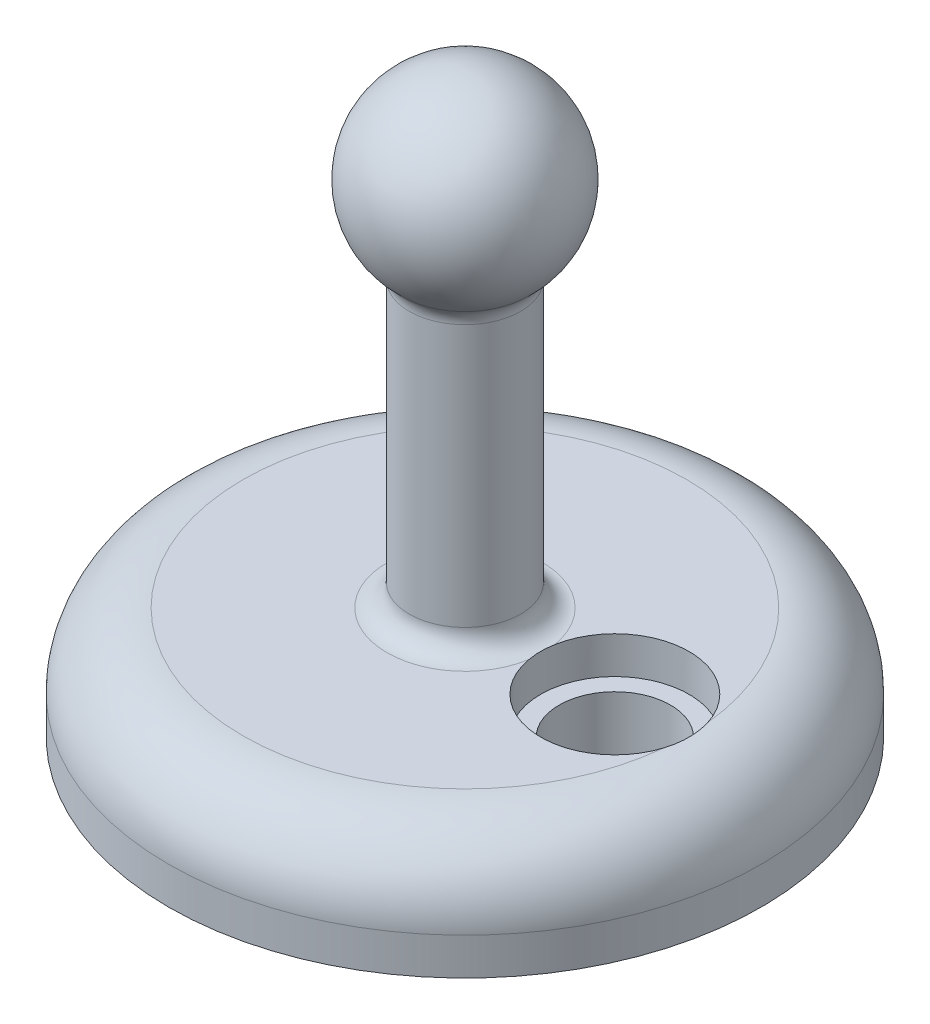
from build123d import *

# Parameters (mm, degrees)
SKETCH1_R               = 39.901069585
BOSS_EXTRUDE1_DEPTH     = 15
FILLET1_R               = 10
SKETCH2_R               = 1.55
CUT_EXTRUDE1_DEPTH      = 10
FILLET2_R               = 1
SKETCH3_R               = 2.5
CUT_EXTRUDE2_DEPTH      = 6
SKETCH4_R               = 7.5
BOSS_EXTRUDE2_DEPTH     = 50
FILLET3_R               = 3
CUT_EXTRUDE4_DEPTH      = 10
CUT_EXTRUDE4_DEPTH_BACK = 15
SKETCH6_R               = 7.5
CUT_EXTRUDE5_DEPTH      = 5
CUT_EXTRUDE5_DEPTH_BACK = 5
SKETCH7_R               = 10
SKETCH8_W               = 1.346153846
SKETCH8_H               = 0.358974359
SKETCH8_W_2             = 0.314102565
SKETCH8_H_2             = 2.557692308
CUT_EXTRUDE6_DEPTH      = 1


with BuildPart() as part:
    # Sketch1 → Boss-Extrude1 (new body)
    with BuildSketch(Plane(origin=(0, 0, 0), x_dir=(1, 0, 0), z_dir=(0, 1, 0))):
        with Locations(Location((0, 0, 0), (0, 0, 270))):
            Circle(SKETCH1_R)
    extrude(amount=BOSS_EXTRUDE1_DEPTH)

    # Fillet1
    fillet1_edges = [part.edges().sort_by_distance(p)[0] for p in [
        (0, 15, -39.901069585),
    ]]
    fillet(fillet1_edges, radius=FILLET1_R)

    # Sketch2 → Cut-Extrude1 (cut)
    with BuildSketch(Plane.XZ):
        with Locations(Location((-16.5, 28.578838325, 0), (0, 0, 270))):
            Circle(SKETCH2_R)
        with Locations(Location((16.5, 28.578838325, 0), (0, 0, 270))):
            Circle(SKETCH2_R)
        with Locations(Location((33, 0, 0), (0, 0, 270))):
            Circle(SKETCH2_R)
        with Locations(Location((16.5, -28.578838325, 0), (0, 0, 270))):
            Circle(SKETCH2_R)
        with Locations(Location((-16.5, -28.578838325, 0), (0, 0, 270))):
            Circle(SKETCH2_R)
        with Locations(Location((-33, 0, 0), (0, 0, 270))):
            Circle(SKETCH2_R)
    extrude(amount=-CUT_EXTRUDE1_DEPTH, mode=Mode.SUBTRACT)

    # Fillet2
    fillet2_edges = [part.edges().sort_by_distance(p)[0] for p in [
        (-16.5, 10, 30.128838325),
        (-33, 10, 1.55),
        (-16.5, 10, -27.028838325),
        (16.5, 10, -27.028838325),
        (33, 10, 1.55),
        (16.5, 10, 30.128838325),
    ]]
    fillet(fillet2_edges, radius=FILLET2_R)

    # Sketch3 → Cut-Extrude2 (cut)
    with BuildSketch(Plane.XZ):
        with Locations(Location((-16.5, 28.578838325, 0), (0, 0, 270))):
            Circle(SKETCH3_R)
        with Locations(Location((-33, 0, 0), (0, 0, 270))):
            Circle(SKETCH3_R)
        with Locations(Location((-16.5, -28.578838325, 0), (0, 0, 270))):
            Circle(SKETCH3_R)
        with Locations(Location((16.5, -28.578838325, 0), (0, 0, 270))):
            Circle(SKETCH3_R)
        with Locations(Location((33, 0, 0), (0, 0, 270))):
            Circle(SKETCH3_R)
        with Locations(Location((16.5, 28.578838325, 0), (0, 0, 270))):
            Circle(SKETCH3_R)
    extrude(amount=-CUT_EXTRUDE2_DEPTH, mode=Mode.SUBTRACT)

    # Sketch4 → Boss-Extrude2 (add)
    with BuildSketch(Plane(origin=(0, 15, 0), x_dir=(1, 0, 0), z_dir=(0, 1, 0))):
        with Locations(Location((0, 0, 0), (0, 0, 270))):
            Circle(SKETCH4_R)
    extrude(amount=BOSS_EXTRUDE2_DEPTH)

    # Sketch5 → Revolve1 (revolve)
    with BuildSketch(Plane.XY):
        with BuildLine():
            Line((0, 77.7), (0, 52.3))
            ThreePointArc((0, 52.3), (12.7, 65), (0, 77.7))
        make_face()
    revolve(axis=Axis((0, 77.7, 0), (0, -1, 0)))

    # Fillet3
    fillet3_edges = [part.edges().sort_by_distance(p)[0] for p in [
        (0, 15, -7.5),
        (-5.303300859, 54.75109762, -5.303300859),
    ]]
    fillet(fillet3_edges, radius=FILLET3_R)

    # Sketch6 → Cut-Extrude4 (cut, two sides: drawn at the far end of the back side and taken through both)
    with BuildSketch(Plane(origin=(0, 15, 0), x_dir=(1, 0, 0), z_dir=(0, 1, 0)).offset(-CUT_EXTRUDE4_DEPTH_BACK)):
        with Locations(Location((20.200534793, 0, 0), (0, 0, 270))):
            Circle(SKETCH6_R)
    extrude(amount=CUT_EXTRUDE4_DEPTH + CUT_EXTRUDE4_DEPTH_BACK, mode=Mode.SUBTRACT)

    # Sketch7 → Cut-Extrude5 (cut, two sides: drawn at the far end of the back side and taken through both)
    with BuildSketch(Plane(origin=(0, 15, 0), x_dir=(1, 0, 0), z_dir=(0, 1, 0)).offset(-CUT_EXTRUDE5_DEPTH_BACK)):
        with Locations(Location((20.200534793, 0, 0), (0, 0, 17.166550599))):
            Circle(SKETCH7_R)
    extrude(amount=CUT_EXTRUDE5_DEPTH + CUT_EXTRUDE5_DEPTH_BACK, mode=Mode.SUBTRACT)

    # Sketch8 → Cut-Extrude6 (cut)
    # profile 1 of 27: a face of its own
    with BuildSketch(Plane.XZ):
        with BuildLine():
            Line((6.626332559, 20.161559811), (7.312730796, 20.161559811))
            add(Edge.make_bspline(
                [(7.312730796, 20.161559811), (7.359941702, 20.161507915), (7.450399895, 20.161408479), (7.580114951, 20.158393734), (7.697924682, 20.154367041), (7.803575063, 20.148785148), (7.897391161, 20.142188558), (7.978948461, 20.132936519), (8.048888017, 20.123276223), (8.090794467, 20.113454817), (8.109906277, 20.108975676)],
                knots=[0, 0, 0, 0, 1.415646017, 2.712440637, 3.8905458, 4.950247383, 5.884950622, 6.709939814, 7.411656543, 8, 8, 8, 8], degree=3))
            add(Edge.make_bspline(
                [(8.109906277, 20.108975676), (8.134099811, 20.102353727), (8.181916788, 20.089265865), (8.250817831, 20.063052141), (8.316371677, 20.031969976), (8.378803235, 19.996546036), (8.437345318, 19.955260472), (8.492871359, 19.909786855), (8.544891339, 19.859075286), (8.593112731, 19.803694546), (8.637397529, 19.744574336), (8.675527211, 19.680832106), (8.707454439, 19.613540803), (8.73483771, 19.542747232), (8.754546164, 19.467856908), (8.769393064, 19.389390196), (8.778816692, 19.307355506), (8.779719254, 19.251295638), (8.780178713, 19.222757728)],
                knots=[0, 0, 0, 0, 0.999701418, 1.975846123, 2.934577507, 3.890451536, 4.834027766, 5.787354733, 6.749476667, 7.726910423, 8.712836071, 9.690891519, 10.682875813, 11.679750201, 12.712814741, 13.765529915, 14.8625177, 16, 16, 16, 16], degree=3))
            add(Edge.make_bspline(
                [(8.780178713, 19.222757728), (8.779757288, 19.193979951), (8.778932742, 19.137674287), (8.769036457, 19.055301499), (8.755706265, 18.976583109), (8.735209213, 18.901693658), (8.70836354, 18.831077888), (8.676871487, 18.763656656), (8.638887957, 18.700576984), (8.595243127, 18.641609866), (8.546691532, 18.586699954), (8.493438594, 18.536245159), (8.435699302, 18.490540821), (8.373657154, 18.449484477), (8.306707305, 18.414028198), (8.235865151, 18.382270893), (8.160514935, 18.355599832), (8.108372421, 18.341569771), (8.081861405, 18.334436414)],
                knots=[0, 0, 0, 0, 1.121902311, 2.195077645, 3.232258892, 4.234102512, 5.217864754, 6.176164875, 7.132989551, 8.084763148, 9.034132444, 9.988522005, 10.94243251, 11.903244335, 12.886203696, 13.894208494, 14.929344452, 16, 16, 16, 16], degree=3))
            add(Edge.make_bspline(
                [(8.081861405, 18.334436414), (8.059934071, 18.329773433), (8.011879044, 18.319554238), (7.932736322, 18.308145782), (7.840590936, 18.298408181), (7.735568656, 18.291107043), (7.617763751, 18.284856675), (7.487112494, 18.279888581), (7.343358416, 18.277158727), (7.243087172, 18.277017934), (7.190735604, 18.276944426)],
                knots=[0, 0, 0, 0, 0.601384939, 1.31797006, 2.144135048, 3.087295005, 4.142315834, 5.309527816, 6.595305764, 8, 8, 8, 8], degree=3))
            Line((7.190735604, 18.276944426), (6.940435123, 18.276944426))
            Line((6.940435123, 18.276944426), (6.940435123, 16.661559811))
            Line((6.940435123, 16.661559811), (6.626332559, 16.661559811))
            Line((6.626332559, 16.661559811), (6.626332559, 20.161559811))
        make_face()
        with BuildLine():
            Line((6.940435123, 19.802585452), (6.940435123, 18.635918785))
            Line((6.940435123, 18.635918785), (7.553215572, 18.628206446))
            add(Edge.make_bspline(
                [(7.553215572, 18.628206446), (7.583135498, 18.628190982), (7.640895298, 18.62816113), (7.724331521, 18.632146353), (7.801740808, 18.636746886), (7.872885383, 18.64348281), (7.937797318, 18.653004067), (7.996584847, 18.662615805), (8.04879213, 18.676521168), (8.109891331, 18.695244237), (8.177974679, 18.727176852), (8.252042227, 18.773526742), (8.314812814, 18.832607451), (8.369131111, 18.899035282), (8.412236989, 18.972934411), (8.443792981, 19.052003348), (8.462334138, 19.135431198), (8.464820332, 19.192519336), (8.466076149, 19.221355484)],
                knots=[0, 0, 0, 0, 1.160613943, 2.240541288, 3.23993089, 4.169200891, 5.011653406, 5.7853311, 6.478053781, 7.106038997, 8.262395093, 9.384106736, 10.481365981, 11.59014053, 12.70357646, 13.786202915, 14.881775077, 16, 16, 16, 16], degree=3))
            add(Edge.make_bspline(
                [(8.466076149, 19.221355484), (8.464813502, 19.249493998), (8.462303517, 19.30542988), (8.443647654, 19.38740864), (8.41229834, 19.465644345), (8.368841746, 19.53861743), (8.316100616, 19.604806234), (8.254801273, 19.662303361), (8.185088011, 19.708525064), (8.12023978, 19.738358346), (8.062638594, 19.756573621), (8.012606634, 19.769318461), (7.95611596, 19.779494068), (7.89314818, 19.78773357), (7.824191347, 19.794787032), (7.748653032, 19.799573009), (7.666819388, 19.802374465), (7.610008817, 19.80251342), (7.580559322, 19.802585452)],
                knots=[0, 0, 0, 0, 1.120700087, 2.227813068, 3.331159281, 4.466773991, 5.599788987, 6.693661531, 7.80175334, 8.91857717, 9.525282508, 10.207424825, 10.974604443, 11.810962634, 12.737642355, 13.736264703, 14.826523623, 16, 16, 16, 16], degree=3))
            Line((7.580559322, 19.802585452), (6.940435123, 19.802585452))
        make_face(mode=Mode.SUBTRACT)
    # profile 2 of 27: a face of its own
    with BuildSketch(Plane.XZ):
        with BuildLine():
            Line((3.485306918, 20.161559811), (3.799409482, 20.161559811))
            Line((3.799409482, 20.161559811), (3.799409482, 18.064504523))
            add(Edge.make_bspline(
                [(3.799409482, 18.064504523), (3.799362738, 18.034823787), (3.799274033, 17.978499476), (3.799866547, 17.898331175), (3.801525916, 17.827058716), (3.802572075, 17.764407369), (3.804899409, 17.710664621), (3.806797456, 17.665539311), (3.809238012, 17.629245108), (3.81217113, 17.608064182), (3.813431918, 17.598959651)],
                knots=[0, 0, 0, 0, 1.528628734, 2.90083645, 4.128790002, 5.200304208, 6.127813768, 6.898992206, 7.526736466, 8, 8, 8, 8], degree=3))
            add(Edge.make_bspline(
                [(3.813431918, 17.598959651), (3.818609377, 17.566112887), (3.828672563, 17.502270158), (3.854318941, 17.411361876), (3.890136442, 17.329430418), (3.932579485, 17.253919127), (3.988512096, 17.186929767), (4.055515631, 17.125218114), (4.1366934, 17.07124631), (4.226954005, 17.021895498), (4.324239243, 16.982230415), (4.423650509, 16.952237051), (4.523693488, 16.933958151), (4.590669654, 16.931841612), (4.623928713, 16.93079058)],
                knots=[0, 0, 0, 0, 1.035780045, 2.013197591, 2.933192213, 3.817615948, 4.702609284, 5.640816605, 6.646850145, 7.73207398, 8.84249596, 9.914020372, 10.964143139, 12, 12, 12, 12], degree=3))
            add(Edge.make_bspline(
                [(4.623928713, 16.93079058), (4.652482453, 16.931864431), (4.709425015, 16.934005929), (4.794031446, 16.94726736), (4.876431554, 16.971167926), (4.957032234, 17.002007684), (5.032583219, 17.042755275), (5.103126661, 17.089826115), (5.166090595, 17.145036991), (5.223548593, 17.206137335), (5.273583529, 17.275077135), (5.31695467, 17.350355273), (5.3524806, 17.43310462), (5.370024125, 17.491259042), (5.379036886, 17.521135132)],
                knots=[0, 0, 0, 0, 0.994687771, 1.983630487, 2.973142513, 3.978332533, 4.983357753, 5.956394766, 6.925816176, 7.893390482, 8.871859704, 9.88551698, 10.913711441, 12, 12, 12, 12], degree=3))
            add(Edge.make_bspline(
                [(5.379036886, 17.521135132), (5.382037011, 17.533483706), (5.388722499, 17.561001306), (5.394969544, 17.607522597), (5.40147607, 17.662411961), (5.40599064, 17.726063773), (5.41039186, 17.798264746), (5.413024933, 17.879391003), (5.414241966, 17.969147964), (5.414604646, 18.031785126), (5.414794097, 18.064504523)],
                knots=[0, 0, 0, 0, 0.558680831, 1.244966039, 2.062412453, 2.990489873, 4.051219941, 5.244515665, 6.560634259, 8, 8, 8, 8], degree=3))
            Line((5.414794097, 18.064504523), (5.414794097, 20.161559811))
            Line((5.414794097, 20.161559811), (5.728896662, 20.161559811))
            Line((5.728896662, 20.161559811), (5.728896662, 18.0476776))
            add(Edge.make_bspline(
                [(5.728896662, 18.0476776), (5.728642541, 18.009579221), (5.72814661, 17.935227918), (5.723846033, 17.826276559), (5.716989033, 17.722923577), (5.707300945, 17.625155081), (5.694463942, 17.533320922), (5.680188722, 17.446616153), (5.662009189, 17.365663161), (5.640775788, 17.289830743), (5.61650224, 17.21764523), (5.585061091, 17.149136615), (5.549636591, 17.082222215), (5.507621938, 17.017914107), (5.460410556, 16.955927553), (5.406958875, 16.896638478), (5.349034714, 16.839099432), (5.285675154, 16.784786366), (5.217924629, 16.734977689), (5.145984672, 16.691179918), (5.070407902, 16.654156301), (4.991390776, 16.623680376), (4.908899573, 16.600765777), (4.822932213, 16.583690621), (4.73329302, 16.573988324), (4.672328364, 16.572546394), (4.641456758, 16.571816221)],
                knots=[0, 0, 0, 0, 1.316592851, 2.569410997, 3.76748051, 4.895814652, 5.963796859, 6.97159953, 7.931736103, 8.829262218, 9.692595152, 10.560224239, 11.431080259, 12.30701507, 13.211635791, 14.121146779, 15.063487852, 16.031507147, 17.00238618, 17.966455255, 18.938106653, 19.907068911, 20.888905087, 21.893141452, 22.933117798, 24, 24, 24, 24], degree=3))
            add(Edge.make_bspline(
                [(4.641456758, 16.571816221), (4.607787655, 16.572600987), (4.541728996, 16.574140693), (4.444390929, 16.582963443), (4.351076733, 16.599581838), (4.260800856, 16.620741781), (4.174792358, 16.649925519), (4.091898914, 16.684023644), (4.013540233, 16.725900904), (3.938445104, 16.772494297), (3.868620348, 16.824918935), (3.804522945, 16.882059109), (3.746047075, 16.942999486), (3.694178378, 17.008399852), (3.648057494, 17.077751559), (3.60832728, 17.151250799), (3.574214036, 17.228869115), (3.556607469, 17.282822316), (3.547706758, 17.310097471)],
                knots=[0, 0, 0, 0, 1.13879206, 2.234305948, 3.301075583, 4.341971843, 5.366689343, 6.369221514, 7.369726634, 8.367512178, 9.355451585, 10.318319045, 11.268648973, 12.207971039, 13.137398894, 14.081662264, 15.030215811, 16, 16, 16, 16], degree=3))
            add(Edge.make_bspline(
                [(3.547706758, 17.310097471), (3.5425296, 17.328730046), (3.531300228, 17.369144515), (3.519274931, 17.436031003), (3.509165849, 17.513045921), (3.499660291, 17.600194539), (3.494051333, 17.697544406), (3.489133894, 17.805053322), (3.485272275, 17.922851283), (3.485295048, 18.004905799), (3.485306918, 18.0476776)],
                knots=[0, 0, 0, 0, 0.625038921, 1.35572334, 2.194682327, 3.136881307, 4.189498639, 5.346923369, 6.617055217, 8, 8, 8, 8], degree=3))
            Line((3.485306918, 18.0476776), (3.485306918, 20.161559811))
        make_face()
    # profile 3 of 27: a face of its own
    with BuildSketch(Plane.XZ):
        Polygon((1.286588969, 20.161559811), (1.555819738, 20.161559811), (2.722486405, 17.514123914), (2.383844578, 17.514123914), (1.421204354, 19.698118305), (0.458564129, 17.514123914), (0.119922303, 17.514123914), align=None)
    # profile 4 of 27: a face of its own
    with BuildSketch(Plane.XZ):
        with BuildLine():
            Line((6.940435123, 12.251303401), (6.626332559, 12.251303401))
            add(Edge.make_bspline(
                [(6.626332559, 12.251303401), (6.628379712, 12.292974289), (6.632400266, 12.374814803), (6.651228555, 12.49413871), (6.678169432, 12.608193508), (6.716260886, 12.716063422), (6.763567164, 12.81870223), (6.820297192, 12.915702245), (6.887491042, 13.006693434), (6.963697776, 13.090832277), (7.046466415, 13.168019848), (7.135772355, 13.234675091), (7.229617382, 13.290992762), (7.327716781, 13.338074004), (7.431177345, 13.37341385), (7.539060202, 13.39963549), (7.651839339, 13.415411835), (7.728679361, 13.417107621), (7.767758841, 13.417970068)],
                knots=[0, 0, 0, 0, 1.10065271, 2.161652631, 3.183658789, 4.190468796, 5.17591951, 6.163126047, 7.15150782, 8.156236427, 9.156009102, 10.134482811, 11.092018607, 12.041330605, 13.001268258, 13.972401359, 14.968799086, 16, 16, 16, 16], degree=3))
            add(Edge.make_bspline(
                [(7.767758841, 13.417970068), (7.806136915, 13.417071611), (7.88154846, 13.415306176), (7.991610474, 13.400145147), (8.096387769, 13.376399555), (8.195675535, 13.343084139), (8.2886816, 13.298299712), (8.376104644, 13.244502173), (8.458985455, 13.182282342), (8.533592239, 13.109028528), (8.602100318, 13.030826144), (8.661202573, 12.94733824), (8.711815737, 12.861108954), (8.754003416, 12.771480753), (8.785059555, 12.677609724), (8.808637763, 12.580862522), (8.821965177, 12.480237711), (8.824010601, 12.412131155), (8.825050508, 12.377505324)],
                knots=[0, 0, 0, 0, 1.111607364, 2.184268762, 3.212621178, 4.221274766, 5.211760367, 6.196651075, 7.1921475, 8.207485113, 9.220403448, 10.201281604, 11.166441695, 12.114753415, 13.065576456, 14.026450734, 14.996634279, 16, 16, 16, 16], degree=3))
            add(Edge.make_bspline(
                [(8.825050508, 12.377505324), (8.823357245, 12.328757489), (8.820000433, 12.232117276), (8.791286057, 12.090102413), (8.746439546, 11.952508994), (8.692442189, 11.841771692), (8.637969745, 11.752538198), (8.588882237, 11.679069493), (8.531417426, 11.599964025), (8.464738928, 11.515486687), (8.390226056, 11.424975782), (8.307203893, 11.328485987), (8.215080411, 11.227014217), (8.15042191, 11.157708616), (8.116917495, 11.121796189)],
                knots=[0, 0, 0, 0, 1.184426356, 2.348067706, 3.509069118, 4.696110526, 5.333549288, 6.050745305, 6.844228056, 7.710549037, 8.667450064, 9.695053472, 10.805634456, 12, 12, 12, 12], degree=3))
            Line((8.116917495, 11.121796189), (7.241216373, 10.187200837))
            Line((7.241216373, 10.187200837), (8.869922303, 10.187200837))
            Line((8.869922303, 10.187200837), (8.869922303, 9.828226478))
            Line((8.869922303, 9.828226478), (6.491717174, 9.828226478))
            Line((6.491717174, 9.828226478), (7.849088969, 11.276744106))
            add(Edge.make_bspline(
                [(7.849088969, 11.276744106), (7.882136856, 11.311242413), (7.945615083, 11.377506599), (8.03539766, 11.474249559), (8.116036648, 11.5639991), (8.188054041, 11.646585648), (8.249887546, 11.723217216), (8.304759778, 11.79141192), (8.348725369, 11.85416637), (8.396440765, 11.926906984), (8.442654746, 12.015719301), (8.482367102, 12.12425299), (8.506581951, 12.235980243), (8.509486786, 12.31148228), (8.510947944, 12.349460452)],
                knots=[0, 0, 0, 0, 1.329631726, 2.553950428, 3.673215718, 4.687767853, 5.603093632, 6.413772471, 7.123043292, 7.734684054, 8.834405432, 9.900288307, 10.943827018, 12, 12, 12, 12], degree=3))
            add(Edge.make_bspline(
                [(8.510947944, 12.349460452), (8.510312201, 12.373341851), (8.509059275, 12.420407501), (8.498001578, 12.48941326), (8.481291072, 12.555978074), (8.457345814, 12.620306693), (8.425739074, 12.681752345), (8.387265694, 12.740389825), (8.34287563, 12.79707879), (8.291524361, 12.850232088), (8.235112841, 12.898913294), (8.175518592, 12.942037379), (8.112468487, 12.97807649), (8.046228365, 13.007619987), (7.976982896, 13.030795368), (7.904598151, 13.046853948), (7.829274134, 13.056936432), (7.777840639, 13.058300604), (7.75163304, 13.058995709)],
                knots=[0, 0, 0, 0, 0.991446411, 1.95395049, 2.89581595, 3.838931463, 4.798493298, 5.75982156, 6.748411868, 7.785213223, 8.824556874, 9.840280684, 10.836137867, 11.835679398, 12.848801643, 13.863922112, 14.911575587, 16, 16, 16, 16], degree=3))
            add(Edge.make_bspline(
                [(7.75163304, 13.058995709), (7.724262207, 13.058280676), (7.670510411, 13.056876471), (7.591591378, 13.047053807), (7.5163056, 13.030107967), (7.444463697, 13.006931292), (7.375944112, 12.977472743), (7.311080068, 12.940780999), (7.250017178, 12.896997506), (7.192640655, 12.847356949), (7.139776676, 12.792089348), (7.0933298, 12.730479385), (7.052745786, 12.66365197), (7.017336552, 12.591787419), (6.988580862, 12.514233639), (6.966607712, 12.431265934), (6.949220865, 12.343244553), (6.943412345, 12.282459468), (6.940435123, 12.251303401)],
                knots=[0, 0, 0, 0, 1.031018746, 2.02475058, 2.990194455, 3.934040569, 4.864654155, 5.795059489, 6.735614925, 7.690564532, 8.649604399, 9.611025574, 10.590972636, 11.591080095, 12.624614302, 13.701020113, 14.821632451, 16, 16, 16, 16], degree=3))
        make_face()
    # profile 5 of 27: a face of its own
    with BuildSketch(Plane.XZ):
        Polygon((3.171204354, 13.328226478), (3.507742815, 13.328226478), (4.674409482, 10.570013337), (5.841076149, 13.328226478), (6.17761461, 13.328226478), (4.696845379, 9.828226478), (4.651973585, 9.828226478), align=None)
    # profile 6 of 27: a face of its own
    with BuildSketch(Plane.XZ):
        Polygon((0.703255636, 13.417970068), (1.0173582, 13.417970068), (1.0173582, 12.385918785), (1.466076149, 12.385918785), (1.466076149, 12.071816221), (1.0173582, 12.071816221), (1.0173582, 9.828226478), (0.703255636, 9.828226478), (0.703255636, 12.071816221), (0.254537687, 12.071816221), (0.254537687, 12.385918785), (0.703255636, 12.385918785), align=None)
    # profile 7 of 27: a face of its own
    with BuildSketch(Plane.XZ):
        with BuildLine():
            Line((-2.617257185, 12.385918785), (-2.303154621, 12.385918785))
            Line((-2.303154621, 12.385918785), (-2.303154621, 11.199620709))
            add(Edge.make_bspline(
                [(-2.303154621, 11.199620709), (-2.303012716, 11.164797959), (-2.302741258, 11.098183671), (-2.300900317, 11.002328485), (-2.296570224, 10.914911772), (-2.291156399, 10.835883035), (-2.284194263, 10.765255644), (-2.275910902, 10.703276287), (-2.266652481, 10.649242102), (-2.257589767, 10.616698747), (-2.253374973, 10.601563818)],
                knots=[0, 0, 0, 0, 1.388932606, 2.656963016, 3.823490214, 4.879454478, 5.816252168, 6.653371382, 7.373723809, 8, 8, 8, 8], degree=3))
            add(Edge.make_bspline(
                [(-2.253374973, 10.601563818), (-2.246613518, 10.582540947), (-2.233231177, 10.544890685), (-2.208957693, 10.49050168), (-2.178929357, 10.440126398), (-2.146069529, 10.391822325), (-2.108170121, 10.347020338), (-2.06571065, 10.305796095), (-2.020112413, 10.266592003), (-1.95235739, 10.220207211), (-1.859698124, 10.170491881), (-1.738045368, 10.127596063), (-1.606141143, 10.101960243), (-1.514976423, 10.098985988), (-1.468118563, 10.097457247)],
                knots=[0, 0, 0, 0, 0.725840625, 1.436591201, 2.137033971, 2.831655856, 3.53531722, 4.242432219, 4.957935707, 5.694543706, 7.190802206, 8.724350549, 10.316345118, 12, 12, 12, 12], degree=3))
            add(Edge.make_bspline(
                [(-1.468118563, 10.097457247), (-1.421265055, 10.099018496), (-1.330612187, 10.102039223), (-1.200157218, 10.126822761), (-1.080905803, 10.16822845), (-0.974054852, 10.226035862), (-0.880089012, 10.296777925), (-0.801784593, 10.379786734), (-0.737177338, 10.472436121), (-0.708967918, 10.541560399), (-0.694781223, 10.576323433)],
                knots=[0, 0, 0, 0, 1.157059328, 2.238695713, 3.266970494, 4.264342957, 5.228770407, 6.160125903, 7.074715775, 8, 8, 8, 8], degree=3))
            add(Edge.make_bspline(
                [(-0.694781223, 10.576323433), (-0.690586993, 10.590289732), (-0.681314575, 10.621165807), (-0.671352223, 10.673545555), (-0.662377762, 10.73601016), (-0.654714585, 10.808968369), (-0.649249423, 10.892229521), (-0.646303396, 10.985767597), (-0.642975121, 11.089288957), (-0.642924605, 11.161756717), (-0.64289821, 11.199620709)],
                knots=[0, 0, 0, 0, 0.557542046, 1.232589297, 2.036731608, 2.971723315, 4.038036528, 5.22795436, 6.551621927, 8, 8, 8, 8], degree=3))
            Line((-0.64289821, 11.199620709), (-0.64289821, 12.385918785))
            Line((-0.64289821, 12.385918785), (-0.328795646, 12.385918785))
            Line((-0.328795646, 12.385918785), (-0.328795646, 11.140726478))
            add(Edge.make_bspline(
                [(-0.328795646, 11.140726478), (-0.329237341, 11.098419306), (-0.330094289, 11.016337606), (-0.335601633, 10.897053495), (-0.345051245, 10.78589125), (-0.35939393, 10.68279203), (-0.376259605, 10.587834548), (-0.398015878, 10.500897102), (-0.423994116, 10.422247549), (-0.453299631, 10.350505772), (-0.487921498, 10.285458877), (-0.524748519, 10.223723061), (-0.567273291, 10.166830126), (-0.612043525, 10.111947988), (-0.661845181, 10.061806461), (-0.71574504, 10.015254985), (-0.77298446, 9.971581953), (-0.834833658, 9.932490674), (-0.90038972, 9.897274029), (-0.969733578, 9.866057951), (-1.043714576, 9.841355373), (-1.121378213, 9.820044708), (-1.203104992, 9.803330239), (-1.288816125, 9.791543672), (-1.378482741, 9.784318341), (-1.439592201, 9.783681296), (-1.47092305, 9.783354683)],
                knots=[0, 0, 0, 0, 1.493040784, 2.896703357, 4.213163133, 5.428574705, 6.569057535, 7.615249723, 8.588095153, 9.490268104, 10.346124644, 11.18633936, 12.024365274, 12.850166724, 13.684164916, 14.514361689, 15.362232829, 16.222528818, 17.093394965, 17.986930858, 18.902426812, 19.842810585, 20.827885679, 21.843828298, 22.894529745, 24, 24, 24, 24], degree=3))
            add(Edge.make_bspline(
                [(-1.47092305, 9.783354683), (-1.502019564, 9.78369439), (-1.563127109, 9.784361946), (-1.652798353, 9.791503754), (-1.73874696, 9.803311925), (-1.820667358, 9.820167142), (-1.898641756, 9.841206212), (-1.972985995, 9.866209747), (-2.042829558, 9.897290229), (-2.109011562, 9.932267787), (-2.171013951, 9.971833062), (-2.229122529, 10.015201102), (-2.283259381, 10.062307165), (-2.333436449, 10.112954522), (-2.378949426, 10.167771458), (-2.420365468, 10.226317018), (-2.458322173, 10.288011107), (-2.492674963, 10.35407427), (-2.522186719, 10.426646279), (-2.548241964, 10.506943376), (-2.569552603, 10.595845893), (-2.586895071, 10.693277822), (-2.600846512, 10.798772863), (-2.610532654, 10.912941279), (-2.615948485, 11.035504971), (-2.616811546, 11.120154861), (-2.617257185, 11.163863497)],
                knots=[0, 0, 0, 0, 1.083640291, 2.129454052, 3.13281866, 4.105697902, 5.042300162, 5.946461698, 6.836384745, 7.703652036, 8.553297018, 9.397182691, 10.228592656, 11.052265423, 11.879314572, 12.708807002, 13.549817954, 14.402308542, 15.300838682, 16.27712199, 17.341985831, 18.484375296, 19.725102775, 21.0496083, 22.476576903, 24, 24, 24, 24], degree=3))
            Line((-2.617257185, 11.163863497), (-2.617257185, 12.385918785))
        make_face()
    # profile 8 of 27: a face of its own
    with BuildSketch(Plane.XZ):
        with BuildLine():
            Line((-5.533923851, 12.385918785), (-5.219821287, 12.385918785))
            Line((-5.219821287, 12.385918785), (-5.219821287, 11.924580644))
            add(Edge.make_bspline(
                [(-5.219821287, 11.924580644), (-5.186283652, 11.966423367), (-5.121202701, 12.047620631), (-5.012818368, 12.154341205), (-4.898274467, 12.24228643), (-4.778272464, 12.312390224), (-4.652649454, 12.36523685), (-4.522171184, 12.403402782), (-4.386056478, 12.42628761), (-4.293492041, 12.42927784), (-4.246664236, 12.43079058)],
                knots=[0, 0, 0, 0, 1.12780773, 2.188550248, 3.19190651, 4.159438251, 5.104880172, 6.052711206, 7.014878035, 8, 8, 8, 8], degree=3))
            add(Edge.make_bspline(
                [(-4.246664236, 12.43079058), (-4.199333602, 12.429045385), (-4.106696134, 12.425629616), (-3.971818073, 12.398612925), (-3.845844679, 12.35246767), (-3.729225123, 12.2892556), (-3.62409791, 12.210649126), (-3.531773058, 12.119071345), (-3.455409811, 12.013735261), (-3.404212448, 11.916012105), (-3.3704868, 11.829323311), (-3.349254463, 11.755076561), (-3.331223481, 11.67235841), (-3.315591733, 11.581418821), (-3.305014621, 11.48162063), (-3.29667233, 11.373372938), (-3.290693636, 11.256710808), (-3.290456429, 11.17602418), (-3.290334108, 11.134416382)],
                knots=[0, 0, 0, 0, 1.235846778, 2.418850247, 3.575807741, 4.728682307, 5.871620074, 6.994088408, 8.11269785, 9.256955736, 9.865816715, 10.540099792, 11.271859618, 12.076849838, 12.949306005, 13.892391288, 14.913166135, 16, 16, 16, 16], degree=3))
            Line((-3.290334108, 11.134416382), (-3.290334108, 9.828226478))
            Line((-3.290334108, 9.828226478), (-3.604436672, 9.828226478))
            Line((-3.604436672, 9.828226478), (-3.604436672, 11.031351478))
            add(Edge.make_bspline(
                [(-3.604436672, 11.031351478), (-3.60462988, 11.066173923), (-3.604999454, 11.132783333), (-3.606165101, 11.228152357), (-3.608974907, 11.314638935), (-3.61292322, 11.392036302), (-3.618702251, 11.460270139), (-3.624724882, 11.519479416), (-3.632089859, 11.569588958), (-3.638652772, 11.599754041), (-3.641596127, 11.613282568)],
                knots=[0, 0, 0, 0, 1.430800155, 2.736877192, 3.918605307, 4.986035426, 5.920637409, 6.731861385, 7.431261377, 8, 8, 8, 8], degree=3))
            add(Edge.make_bspline(
                [(-3.641596127, 11.613282568), (-3.652221658, 11.652993752), (-3.672672519, 11.729425497), (-3.723206502, 11.83309985), (-3.787020683, 11.921298038), (-3.864918532, 11.993474759), (-3.956147608, 12.049645596), (-4.060454751, 12.088619551), (-4.176833391, 12.11299582), (-4.258687774, 12.115422952), (-4.301351736, 12.116688016)],
                knots=[0, 0, 0, 0, 1.084156227, 2.086665306, 3.027808233, 3.945421172, 4.874247719, 5.839848303, 6.874090471, 8, 8, 8, 8], degree=3))
            add(Edge.make_bspline(
                [(-4.301351736, 12.116688016), (-4.326619419, 12.116212012), (-4.376623512, 12.115270011), (-4.450773484, 12.105818713), (-4.522697658, 12.090360257), (-4.593117867, 12.06949162), (-4.66062566, 12.04082935), (-4.727389951, 12.00829998), (-4.790896716, 11.967751768), (-4.852500113, 11.922561147), (-4.90981292, 11.872481939), (-4.963141259, 11.819637429), (-5.010679279, 11.763361825), (-5.053747954, 11.704561878), (-5.090926218, 11.64243004), (-5.123379306, 11.577565733), (-5.150915001, 11.509883585), (-5.164597693, 11.462908523), (-5.171443883, 11.439404362)],
                knots=[0, 0, 0, 0, 1.023777757, 2.026029729, 3.023749952, 4.003683103, 4.997618607, 5.993177895, 7.010360494, 8.046726602, 9.087585522, 10.09234134, 11.086953743, 12.070360549, 13.043493632, 14.017870808, 15.008233677, 16, 16, 16, 16], degree=3))
            add(Edge.make_bspline(
                [(-5.171443883, 11.439404362), (-5.175383532, 11.422149159), (-5.183959941, 11.384585485), (-5.193223121, 11.322941066), (-5.201630696, 11.251631091), (-5.208667655, 11.170738773), (-5.212973071, 11.079980898), (-5.217667468, 10.979745061), (-5.219376529, 10.869631572), (-5.219668883, 10.792969879), (-5.219821287, 10.753006125)],
                knots=[0, 0, 0, 0, 0.615963638, 1.340920617, 2.168419149, 3.115676021, 4.16674242, 5.331190069, 6.6087489, 8, 8, 8, 8], degree=3))
            Line((-5.219821287, 10.753006125), (-5.219821287, 9.828226478))
            Line((-5.219821287, 9.828226478), (-5.533923851, 9.828226478))
            Line((-5.533923851, 9.828226478), (-5.533923851, 12.385918785))
        make_face()
    # profile 9 of 27: a face of its own
    with BuildSketch(Plane.XZ):
        with BuildLine():
            add(Edge.make_bspline(
                [(-7.484444685, 12.43079058), (-7.436453412, 12.429768689), (-7.342354254, 12.42776501), (-7.204546368, 12.406350045), (-7.073001232, 12.37360268), (-6.94721504, 12.328331118), (-6.828798745, 12.267649168), (-6.716027501, 12.195239877), (-6.609210492, 12.109457283), (-6.545187463, 12.043099215), (-6.512689877, 12.009416382)],
                knots=[0, 0, 0, 0, 1.054011418, 2.066658804, 3.057071809, 4.030435133, 4.997543892, 5.974964718, 6.972108034, 8, 8, 8, 8], degree=3))
            add(Edge.make_bspline(
                [(-6.512689877, 12.009416382), (-6.484707923, 11.977202396), (-6.429285543, 11.913397854), (-6.358219824, 11.809942241), (-6.296998264, 11.70280214), (-6.247935303, 11.590554813), (-6.209250279, 11.474180142), (-6.181784583, 11.353278131), (-6.165447648, 11.228115784), (-6.163244681, 11.143111946), (-6.162128979, 11.100061414)],
                knots=[0, 0, 0, 0, 1.025258237, 2.030674902, 3.01204498, 3.988269485, 4.97094183, 5.956517959, 6.965070386, 8, 8, 8, 8], degree=3))
            add(Edge.make_bspline(
                [(-6.162128979, 11.100061414), (-6.163110317, 11.056761356), (-6.165049485, 10.971198423), (-6.183393101, 10.845179057), (-6.211924187, 10.722984234), (-6.252756026, 10.60512554), (-6.305114135, 10.491242713), (-6.369004822, 10.381833164), (-6.444876439, 10.27668103), (-6.530880436, 10.176679192), (-6.625932312, 10.084512977), (-6.729048461, 10.004184708), (-6.838202494, 9.935363183), (-6.954845848, 9.879926768), (-7.077913335, 9.836217068), (-7.207670403, 9.805517051), (-7.343915473, 9.786955367), (-7.436942694, 9.784571794), (-7.484444685, 9.783354683)],
                knots=[0, 0, 0, 0, 0.998656419, 1.973391657, 2.932242238, 3.890759089, 4.846373663, 5.82037756, 6.809684879, 7.83454468, 8.860553229, 9.859544525, 10.845671541, 11.83227036, 12.833544569, 13.85385346, 14.904124723, 16, 16, 16, 16], degree=3))
            add(Edge.make_bspline(
                [(-7.484444685, 9.783354683), (-7.532179404, 9.784575879), (-7.625670264, 9.786967654), (-7.762396246, 9.805444936), (-7.892385865, 9.836202919), (-8.015614463, 9.880070412), (-8.13275931, 9.935364955), (-8.242545807, 10.003976645), (-8.345745723, 10.0845368), (-8.440817707, 10.176672737), (-8.526816312, 10.276682694), (-8.602689321, 10.381832732), (-8.666579647, 10.491242825), (-8.718937851, 10.60512551), (-8.759769664, 10.722984242), (-8.788300756, 10.845179055), (-8.806644371, 10.971198423), (-8.808583539, 11.056761356), (-8.809564877, 11.100061414)],
                knots=[0, 0, 0, 0, 1.099876186, 2.154163076, 3.173186993, 4.173200201, 5.163417411, 6.152872554, 7.150605724, 8.17532212, 9.198891216, 10.186952605, 11.159729845, 12.11414092, 13.071450619, 14.029093627, 15.002601286, 16, 16, 16, 16], degree=3))
            add(Edge.make_bspline(
                [(-8.809564877, 11.100061414), (-8.808441567, 11.14287796), (-8.806217605, 11.227647362), (-8.789897096, 11.352574423), (-8.76253854, 11.473271812), (-8.723807143, 11.589197288), (-8.674291952, 11.700952724), (-8.613930664, 11.808357555), (-8.542140032, 11.911345355), (-8.48693808, 11.975067435), (-8.459003979, 12.007313016)],
                knots=[0, 0, 0, 0, 1.031353054, 2.041901799, 3.029428768, 4.008703097, 4.981709435, 5.96992636, 6.972712378, 8, 8, 8, 8], degree=3))
            add(Edge.make_bspline(
                [(-8.459003979, 12.007313016), (-8.426555388, 12.041287955), (-8.362739525, 12.108105652), (-8.255390797, 12.193638176), (-8.142896976, 12.26755425), (-8.02317205, 12.327030465), (-7.897489192, 12.373868983), (-7.765269949, 12.406434498), (-7.626994434, 12.427687853), (-7.532434813, 12.429746031), (-7.484444685, 12.43079058)],
                knots=[0, 0, 0, 0, 1.027980169, 2.021703884, 2.998553061, 3.971491411, 4.943284454, 5.930300938, 6.949603206, 8, 8, 8, 8], degree=3))
        make_face()
        with BuildLine():
            add(Edge.make_bspline(
                [(-7.485846928, 12.116688016), (-7.51978454, 12.115723425), (-7.586783668, 12.113819142), (-7.685403253, 12.099335237), (-7.780343407, 12.076387733), (-7.871784251, 12.043783677), (-7.959417423, 12.001684778), (-8.043326826, 11.949976418), (-8.123759266, 11.889343461), (-8.199141329, 11.81988079), (-8.268323641, 11.744001795), (-8.328801618, 11.663153436), (-8.380226724, 11.57864709), (-8.423066883, 11.490394879), (-8.454974071, 11.397502465), (-8.478147094, 11.301021834), (-8.492617334, 11.200756417), (-8.494503713, 11.132595399), (-8.495462313, 11.097958048)],
                knots=[0, 0, 0, 0, 1.021534396, 2.016698045, 2.994645724, 3.958388632, 4.93408049, 5.916473867, 6.921342795, 7.962252576, 8.998418191, 10.008913653, 10.997312074, 11.973003931, 12.956656626, 13.948281152, 14.957379055, 16, 16, 16, 16], degree=3))
            add(Edge.make_bspline(
                [(-8.495462313, 11.097958048), (-8.493855489, 11.053206021), (-8.490666245, 10.964381616), (-8.464731008, 10.833570493), (-8.421344728, 10.707988641), (-8.362757449, 10.588372255), (-8.28935123, 10.477699977), (-8.202864163, 10.379028492), (-8.104224463, 10.293842681), (-7.994607963, 10.223161835), (-7.876253645, 10.16700208), (-7.750997324, 10.127203104), (-7.62035663, 10.101331412), (-7.531075899, 10.098759937), (-7.485846928, 10.097457247)],
                knots=[0, 0, 0, 0, 1.016792936, 2.018143844, 3.017858371, 4.030088057, 5.03801393, 6.028138512, 7.003788237, 7.991172063, 8.984598303, 9.972568034, 10.972917682, 12, 12, 12, 12], degree=3))
            add(Edge.make_bspline(
                [(-7.485846928, 10.097457247), (-7.440620559, 10.098767527), (-7.351344963, 10.101353984), (-7.220885786, 10.127072804), (-7.095971815, 10.167176465), (-6.977740427, 10.223098674), (-6.868173824, 10.294111089), (-6.768824702, 10.378547466), (-6.683076091, 10.477961318), (-6.609742486, 10.588518846), (-6.550195744, 10.707803199), (-6.507012542, 10.833593671), (-6.481014956, 10.964375713), (-6.477834127, 11.053204043), (-6.476231544, 11.097958048)],
                knots=[0, 0, 0, 0, 1.02726834, 2.027799167, 3.010890988, 4.004497153, 4.992059811, 5.971914811, 6.958719428, 7.966827853, 8.981595046, 9.981490638, 10.983022906, 12, 12, 12, 12], degree=3))
            add(Edge.make_bspline(
                [(-6.476231544, 11.097958048), (-6.477189814, 11.132595606), (-6.479075543, 11.200757032), (-6.493550507, 11.301019485), (-6.516706047, 11.397511082), (-6.548677664, 11.490363085), (-6.591331678, 11.578875589), (-6.643748471, 11.662905317), (-6.703979496, 11.744281863), (-6.773996617, 11.819635503), (-6.849299995, 11.88937054), (-6.929765033, 11.949999929), (-7.013550012, 12.001457525), (-7.100928595, 12.044143765), (-7.192381162, 12.076091106), (-7.287188291, 12.099467737), (-7.385387101, 12.113757934), (-7.452146144, 12.115705075), (-7.485846928, 12.116688016)],
                knots=[0, 0, 0, 0, 1.042956736, 2.052379634, 3.044323526, 4.02829302, 5.004299113, 5.996692471, 7.007513377, 8.048758398, 9.090003419, 10.095195979, 11.07790575, 12.047570684, 13.018257071, 13.989683339, 14.985167495, 16, 16, 16, 16], degree=3))
        make_face(mode=Mode.SUBTRACT)
    # profile 10 of 27: a face of its own
    with BuildSketch(Plane.XZ):
        with BuildLine():
            Line((-13.251872569, 12.385918785), (-12.937770005, 12.385918785))
            Line((-12.937770005, 12.385918785), (-12.937770005, 11.941407568))
            add(Edge.make_bspline(
                [(-12.937770005, 11.941407568), (-12.909486055, 11.980295169), (-12.855291296, 12.054807542), (-12.766425643, 12.152997827), (-12.677649531, 12.236325981), (-12.613716149, 12.280068853), (-12.583002377, 12.301083048)],
                knots=[0, 0, 0, 0, 1.134379233, 2.173579362, 3.122582517, 4, 4, 4, 4], degree=3))
            add(Edge.make_bspline(
                [(-12.583002377, 12.301083048), (-12.541137715, 12.321088414), (-12.458139815, 12.360749627), (-12.32672059, 12.400983186), (-12.192245921, 12.425708287), (-12.101437707, 12.429089661), (-12.055758787, 12.43079058)],
                knots=[0, 0, 0, 0, 1.014936303, 2.012140481, 3.000054389, 4, 4, 4, 4], degree=3))
            add(Edge.make_bspline(
                [(-12.055758787, 12.43079058), (-12.024865791, 12.42974529), (-11.963730212, 12.427676715), (-11.873146121, 12.41421668), (-11.78528751, 12.390950507), (-11.70067348, 12.358543183), (-11.620952801, 12.319296496), (-11.547863603, 12.273246788), (-11.482239395, 12.221549713), (-11.424113344, 12.16187078), (-11.371844318, 12.092534181), (-11.323765472, 12.011669932), (-11.279340259, 11.917462271), (-11.254718951, 11.84909573), (-11.241756383, 11.813102279)],
                knots=[0, 0, 0, 0, 1.009824226, 1.998387844, 2.986035974, 3.974953746, 4.955485308, 5.885931332, 6.793869504, 7.679848016, 8.601185859, 9.625726857, 10.749998409, 12, 12, 12, 12], degree=3))
            add(Edge.make_bspline(
                [(-11.241756383, 11.813102279), (-11.228045132, 11.837826698), (-11.201063315, 11.886480883), (-11.155757678, 11.955339146), (-11.108289881, 12.019745937), (-11.058255388, 12.079752362), (-11.005830801, 12.135062092), (-10.950769401, 12.185857994), (-10.89338462, 12.232358207), (-10.81359238, 12.286681367), (-10.709779772, 12.344382548), (-10.578891658, 12.394410992), (-10.442741486, 12.425327121), (-10.350323788, 12.428957394), (-10.303655422, 12.43079058)],
                knots=[0, 0, 0, 0, 0.86119277, 1.694706429, 2.50939023, 3.298075842, 4.073795165, 4.829715201, 5.57930267, 6.321991688, 7.768977793, 9.186738141, 10.579381044, 12, 12, 12, 12], degree=3))
            add(Edge.make_bspline(
                [(-10.303655422, 12.43079058), (-10.260773959, 12.429173359), (-10.176850773, 12.426008301), (-10.054673507, 12.401154828), (-9.940731702, 12.358477181), (-9.835254626, 12.300243544), (-9.740094812, 12.227064361), (-9.657378503, 12.139995523), (-9.58760814, 12.0396529), (-9.5420295, 11.945260912), (-9.511114236, 11.861925579), (-9.492053001, 11.790919287), (-9.475213306, 11.712767734), (-9.461232061, 11.627377473), (-9.451013509, 11.534446865), (-9.443442793, 11.434127989), (-9.43831872, 11.326342877), (-9.437956648, 11.251977377), (-9.437770005, 11.213643144)],
                knots=[0, 0, 0, 0, 1.209669288, 2.367440248, 3.500751976, 4.631527125, 5.755587489, 6.87532382, 8.007944318, 9.190864318, 9.82315674, 10.514484317, 11.263564316, 12.079023757, 12.955305781, 13.901327259, 14.918167583, 16, 16, 16, 16], degree=3))
            Line((-9.437770005, 11.213643144), (-9.437770005, 9.828226478))
            Line((-9.437770005, 9.828226478), (-9.751872569, 9.828226478))
            Line((-9.751872569, 9.828226478), (-9.751872569, 11.215045388))
            add(Edge.make_bspline(
                [(-9.751872569, 11.215045388), (-9.751950452, 11.247765962), (-9.752100131, 11.310649929), (-9.754793763, 11.40090238), (-9.759869077, 11.483170737), (-9.765803716, 11.557342825), (-9.774047525, 11.623591614), (-9.784693457, 11.681784032), (-9.795971137, 11.732377844), (-9.814707128, 11.788463891), (-9.84465502, 11.850334102), (-9.8902725, 11.917057678), (-9.947742606, 11.975138478), (-10.014102762, 12.025556795), (-10.089651207, 12.066550436), (-10.17291593, 12.095826446), (-10.263379982, 12.113949324), (-10.32600277, 12.115755339), (-10.358342922, 12.116688016)],
                knots=[0, 0, 0, 0, 1.253487763, 2.409012846, 3.458416907, 4.410876679, 5.259312806, 6.014470957, 6.676830364, 7.243083969, 8.276244668, 9.299465089, 10.325150304, 11.392391894, 12.482080715, 13.603491619, 14.762376348, 16, 16, 16, 16], degree=3))
            add(Edge.make_bspline(
                [(-10.358342922, 12.116688016), (-10.398012876, 12.115271859), (-10.476415787, 12.112472993), (-10.590861274, 12.08389912), (-10.70083229, 12.04081887), (-10.803047423, 11.978386413), (-10.897075214, 11.903578049), (-10.977974791, 11.814628453), (-11.044806977, 11.713998526), (-11.090060953, 11.620851824), (-11.118650254, 11.53718238), (-11.13752717, 11.464085008), (-11.152210562, 11.38100344), (-11.165981091, 11.288495949), (-11.174968819, 11.185925769), (-11.183137191, 11.073767368), (-11.186958054, 10.951683408), (-11.187492513, 10.86705672), (-11.187770005, 10.823118305)],
                knots=[0, 0, 0, 0, 1.090531906, 2.155305635, 3.229839962, 4.33261226, 5.44038871, 6.529323825, 7.629011124, 8.757537029, 9.370236727, 10.061839251, 10.834451254, 11.692844982, 12.636905849, 13.66920014, 14.789842145, 16, 16, 16, 16], degree=3))
            Line((-11.187770005, 10.823118305), (-11.187770005, 9.828226478))
            Line((-11.187770005, 9.828226478), (-11.501872569, 9.828226478))
            Line((-11.501872569, 9.828226478), (-11.501872569, 11.128807407))
            add(Edge.make_bspline(
                [(-11.501872569, 11.128807407), (-11.501952, 11.165500726), (-11.502104817, 11.236094983), (-11.504781135, 11.337328659), (-11.509867756, 11.429409739), (-11.515748305, 11.512231202), (-11.524208483, 11.585642531), (-11.533818245, 11.650037289), (-11.545166856, 11.70525404), (-11.563956741, 11.765817425), (-11.592671209, 11.832538348), (-11.638859471, 11.903679369), (-11.696467051, 11.965947467), (-11.764037927, 12.019106215), (-11.840043609, 12.063047697), (-11.92402701, 12.094707448), (-12.015231923, 12.113131738), (-12.078109629, 12.115480235), (-12.110446287, 12.116688016)],
                knots=[0, 0, 0, 0, 1.320475261, 2.540461679, 3.643808994, 4.639130445, 5.527981419, 6.302341397, 6.981980563, 7.553956391, 8.582137848, 9.585246428, 10.591171744, 11.620968678, 12.668337649, 13.738356861, 14.836885341, 16, 16, 16, 16], degree=3))
            add(Edge.make_bspline(
                [(-12.110446287, 12.116688016), (-12.148462499, 12.115157556), (-12.224227458, 12.112107404), (-12.335529428, 12.08465313), (-12.443015111, 12.041649055), (-12.54496981, 11.981989236), (-12.638643958, 11.908090157), (-12.720652226, 11.821175262), (-12.789594751, 11.722326228), (-12.835326566, 11.630161712), (-12.86482504, 11.548588437), (-12.884420375, 11.479237489), (-12.901260001, 11.402237241), (-12.913774022, 11.31735013), (-12.925854438, 11.225129036), (-12.931684747, 11.125114546), (-12.937356309, 11.017392458), (-12.937628724, 10.943019913), (-12.937770005, 10.904448433)],
                knots=[0, 0, 0, 0, 1.098833095, 2.189935336, 3.297829714, 4.440610912, 5.596351641, 6.740013378, 7.886572111, 9.072425424, 9.705826452, 10.395263256, 11.156850408, 11.985370555, 12.878090359, 13.847760091, 14.883794034, 16, 16, 16, 16], degree=3))
            Line((-12.937770005, 10.904448433), (-12.937770005, 9.828226478))
            Line((-12.937770005, 9.828226478), (-13.251872569, 9.828226478))
            Line((-13.251872569, 9.828226478), (-13.251872569, 12.385918785))
        make_face()
    # profile 11 of 27: a face of its own
    with BuildSketch(Plane.XZ):
        with BuildLine():
            Line((-14.293739556, 10.635918785), (-14.014693082, 10.48938433))
            add(Edge.make_bspline(
                [(-14.014693082, 10.48938433), (-14.036929677, 10.449940999), (-14.080193286, 10.373199896), (-14.154594034, 10.267768036), (-14.232586106, 10.17292032), (-14.317690074, 10.091190666), (-14.407359753, 10.019939281), (-14.502092408, 9.957601456), (-14.602381226, 9.904482936), (-14.70823095, 9.859730408), (-14.820530502, 9.825320914), (-14.939552018, 9.801016693), (-15.065523513, 9.785993424), (-15.151869693, 9.784248283), (-15.196083306, 9.783354683)],
                knots=[0, 0, 0, 0, 1.120438281, 2.179929193, 3.190490725, 4.156257408, 5.095198341, 6.022838206, 6.959905092, 7.901321166, 8.864066838, 9.862729781, 10.905609505, 12, 12, 12, 12], degree=3))
            add(Edge.make_bspline(
                [(-15.196083306, 9.783354683), (-15.245225284, 9.784501858), (-15.341087046, 9.786739665), (-15.480626793, 9.806032129), (-15.612006211, 9.837504488), (-15.735217914, 9.88147003), (-15.849960167, 9.938897354), (-15.956461022, 10.008856835), (-16.055280548, 10.09098909), (-16.143304757, 10.186005534), (-16.22254864, 10.287687491), (-16.29247446, 10.393643375), (-16.350931891, 10.5036066), (-16.398484501, 10.616877124), (-16.436889366, 10.732741017), (-16.46365607, 10.852252485), (-16.479085818, 10.975088069), (-16.481450263, 11.058185405), (-16.4826418, 11.100061414)],
                knots=[0, 0, 0, 0, 1.145258523, 2.234067595, 3.276747158, 4.290159414, 5.277019952, 6.260822364, 7.254936242, 8.264827045, 9.274100331, 10.257902744, 11.220704747, 12.172965371, 13.118907548, 14.062713208, 15.023725156, 16, 16, 16, 16], degree=3))
            add(Edge.make_bspline(
                [(-16.4826418, 11.100061414), (-16.481582659, 11.139356244), (-16.47948358, 11.217233409), (-16.466252793, 11.332498953), (-16.4428045, 11.444527406), (-16.410628176, 11.553411854), (-16.36907693, 11.658969988), (-16.318244711, 11.761266051), (-16.258052333, 11.860191191), (-16.211579659, 11.922594325), (-16.188170646, 11.95402776)],
                knots=[0, 0, 0, 0, 1.024358464, 2.0301432, 3.019427413, 4.004406732, 4.986367066, 5.972626655, 6.978780325, 8, 8, 8, 8], degree=3))
            add(Edge.make_bspline(
                [(-16.188170646, 11.95402776), (-16.156462963, 11.99189663), (-16.094052017, 12.06643478), (-15.988495661, 12.164373106), (-15.874195465, 12.246416881), (-15.752583839, 12.314424017), (-15.622247365, 12.366097664), (-15.484938074, 12.404605247), (-15.339092488, 12.426183258), (-15.239387267, 12.429231091), (-15.188370967, 12.43079058)],
                knots=[0, 0, 0, 0, 1.030682036, 2.02871468, 2.997146059, 3.962720338, 4.930598197, 5.918074684, 6.934738563, 8, 8, 8, 8], degree=3))
            add(Edge.make_bspline(
                [(-15.188370967, 12.43079058), (-15.135923361, 12.429436531), (-15.033033115, 12.426780196), (-14.883000994, 12.402153863), (-14.741040278, 12.363101308), (-14.607207774, 12.307947518), (-14.481489913, 12.236787966), (-14.364703863, 12.148646124), (-14.254852351, 12.046228037), (-14.190943772, 11.967464828), (-14.15842305, 11.927385132)],
                knots=[0, 0, 0, 0, 1.056321875, 2.072262726, 3.055038591, 4.01806755, 4.982017516, 5.957941055, 6.960871419, 8, 8, 8, 8], degree=3))
            add(Edge.make_bspline(
                [(-14.15842305, 11.927385132), (-14.136296112, 11.89718155), (-14.092189519, 11.836975432), (-14.036942419, 11.738804274), (-13.988985024, 11.63609368), (-13.950652063, 11.527183383), (-13.919612561, 11.413363803), (-13.897155743, 11.293821258), (-13.883986124, 11.168591347), (-13.881397427, 11.083264791), (-13.880077697, 11.039764939)],
                knots=[0, 0, 0, 0, 0.94817472, 1.890038105, 2.849395472, 3.817997239, 4.812318967, 5.836947057, 6.897266129, 8, 8, 8, 8], degree=3))
            Line((-13.880077697, 11.039764939), (-16.168539236, 11.039764939))
            add(Edge.make_bspline(
                [(-16.168539236, 11.039764939), (-16.166999629, 11.006064475), (-16.163972056, 10.939793871), (-16.149856912, 10.842823088), (-16.127608139, 10.750449746), (-16.096339076, 10.663366704), (-16.058472231, 10.580436577), (-16.012086514, 10.50227454), (-15.95674696, 10.42923661), (-15.895021261, 10.360669472), (-15.826314165, 10.299608711), (-15.754031418, 10.244956935), (-15.677137853, 10.199151338), (-15.59623977, 10.161971448), (-15.511467984, 10.132865132), (-15.422795789, 10.112997311), (-15.330397673, 10.099690204), (-15.267411939, 10.098210539), (-15.235346127, 10.097457247)],
                knots=[0, 0, 0, 0, 1.094153842, 2.151609401, 3.174256925, 4.172055639, 5.149267565, 6.128595816, 7.11444997, 8.118368179, 9.117203808, 10.09244225, 11.054858984, 12.015122123, 12.976791628, 13.957293641, 14.960065497, 16, 16, 16, 16], degree=3))
            add(Edge.make_bspline(
                [(-15.235346127, 10.097457247), (-15.203994979, 10.098065304), (-15.141788288, 10.099271805), (-15.049147431, 10.111003716), (-14.958007904, 10.129973991), (-14.86874692, 10.155863981), (-14.783176074, 10.187440833), (-14.703930524, 10.225543691), (-14.631050309, 10.267693438), (-14.562933342, 10.315903113), (-14.496862349, 10.3749113), (-14.431319862, 10.448547021), (-14.361043209, 10.535634549), (-14.317053616, 10.601180215), (-14.293739556, 10.635918785)],
                knots=[0, 0, 0, 0, 0.99110716, 1.966546729, 2.947904876, 3.932708344, 4.903319531, 5.828989031, 6.710028674, 7.56322171, 8.463672341, 9.504779593, 10.677557249, 12, 12, 12, 12], degree=3))
        make_face()
        with BuildLine():
            add(Edge.make_bspline(
                [(-14.194180262, 11.353867503), (-14.205676886, 11.395530377), (-14.227804188, 11.475717998), (-14.274040552, 11.586758888), (-14.326112093, 11.685446789), (-14.387733824, 11.771026422), (-14.45755255, 11.847029935), (-14.538197732, 11.91344852), (-14.628633626, 11.972865971), (-14.728392767, 12.023018471), (-14.834034552, 12.06570833), (-14.944640744, 12.094333445), (-15.057498531, 12.113942988), (-15.133832818, 12.115769096), (-15.172245165, 12.116688016)],
                knots=[0, 0, 0, 0, 1.154881502, 2.222775134, 3.210006277, 4.132804581, 5.035138423, 5.962687519, 6.919655026, 7.923214229, 8.944639381, 9.960483929, 10.97369054, 12, 12, 12, 12], degree=3))
            add(Edge.make_bspline(
                [(-15.172245165, 12.116688016), (-15.203594604, 12.116076345), (-15.265565853, 12.114867199), (-15.356866921, 12.103397069), (-15.44454662, 12.084437224), (-15.529251908, 12.058472268), (-15.609872776, 12.023863665), (-15.688067544, 11.983280439), (-15.761847941, 11.933738855), (-15.807989236, 11.89598), (-15.831299653, 11.876904362)],
                knots=[0, 0, 0, 0, 1.04873581, 2.073130211, 3.073294108, 4.04793562, 5.032784715, 6.005352987, 6.992311501, 8, 8, 8, 8], degree=3))
            add(Edge.make_bspline(
                [(-15.831299653, 11.876904362), (-15.847992935, 11.861810047), (-15.881776069, 11.831262831), (-15.92691659, 11.778633624), (-15.970137063, 11.721882062), (-16.009470716, 11.658836937), (-16.045548302, 11.590216158), (-16.079308279, 11.516598523), (-16.109694691, 11.437425393), (-16.126790801, 11.382252954), (-16.135586512, 11.353867503)],
                knots=[0, 0, 0, 0, 0.879870761, 1.780643979, 2.707998968, 3.669668524, 4.684282772, 5.740141944, 6.837334558, 8, 8, 8, 8], degree=3))
            Line((-16.135586512, 11.353867503), (-14.194180262, 11.353867503))
        make_face(mode=Mode.SUBTRACT)
    # profile 12 of 27: a face of its own
    with BuildSketch(Plane.XZ):
        with BuildLine():
            Line((-19.354436672, 12.385918785), (-19.040334108, 12.385918785))
            Line((-19.040334108, 12.385918785), (-19.040334108, 11.924580644))
            add(Edge.make_bspline(
                [(-19.040334108, 11.924580644), (-19.006796473, 11.966423367), (-18.941715522, 12.047620631), (-18.833331188, 12.154341205), (-18.718787288, 12.24228643), (-18.598785284, 12.312390224), (-18.473162274, 12.36523685), (-18.342684004, 12.403402782), (-18.206569298, 12.42628761), (-18.114004861, 12.42927784), (-18.067177056, 12.43079058)],
                knots=[0, 0, 0, 0, 1.12780773, 2.188550248, 3.19190651, 4.159438251, 5.104880172, 6.052711206, 7.014878035, 8, 8, 8, 8], degree=3))
            add(Edge.make_bspline(
                [(-18.067177056, 12.43079058), (-18.019846422, 12.429045385), (-17.927208955, 12.425629616), (-17.792330893, 12.398612925), (-17.666357499, 12.35246767), (-17.549737944, 12.2892556), (-17.44461073, 12.210649126), (-17.352285879, 12.119071345), (-17.275922631, 12.013735261), (-17.224725268, 11.916012105), (-17.190999621, 11.829323311), (-17.169767283, 11.755076561), (-17.151736302, 11.67235841), (-17.136104554, 11.581418821), (-17.125527442, 11.48162063), (-17.11718515, 11.373372938), (-17.111206456, 11.256710808), (-17.110969249, 11.17602418), (-17.110846928, 11.134416382)],
                knots=[0, 0, 0, 0, 1.235846778, 2.418850247, 3.575807741, 4.728682307, 5.871620074, 6.994088408, 8.11269785, 9.256955736, 9.865816715, 10.540099792, 11.271859618, 12.076849838, 12.949306005, 13.892391288, 14.913166135, 16, 16, 16, 16], degree=3))
            Line((-17.110846928, 11.134416382), (-17.110846928, 9.828226478))
            Line((-17.110846928, 9.828226478), (-17.424949492, 9.828226478))
            Line((-17.424949492, 9.828226478), (-17.424949492, 11.031351478))
            add(Edge.make_bspline(
                [(-17.424949492, 11.031351478), (-17.4251427, 11.066173923), (-17.425512274, 11.132783333), (-17.426677921, 11.228152357), (-17.429487728, 11.314638935), (-17.433436041, 11.392036302), (-17.439215071, 11.460270139), (-17.445237702, 11.519479416), (-17.452602679, 11.569588958), (-17.459165592, 11.599754041), (-17.462108947, 11.613282568)],
                knots=[0, 0, 0, 0, 1.430800155, 2.736877192, 3.918605307, 4.986035426, 5.920637409, 6.731861385, 7.431261377, 8, 8, 8, 8], degree=3))
            add(Edge.make_bspline(
                [(-17.462108947, 11.613282568), (-17.472734479, 11.652993752), (-17.49318534, 11.729425497), (-17.543719323, 11.83309985), (-17.607533504, 11.921298038), (-17.685431353, 11.993474759), (-17.776660429, 12.049645596), (-17.880967571, 12.088619551), (-17.997346212, 12.11299582), (-18.079200595, 12.115422952), (-18.121864556, 12.116688016)],
                knots=[0, 0, 0, 0, 1.084156227, 2.086665306, 3.027808233, 3.945421172, 4.874247719, 5.839848303, 6.874090471, 8, 8, 8, 8], degree=3))
            add(Edge.make_bspline(
                [(-18.121864556, 12.116688016), (-18.14713224, 12.116212012), (-18.197136333, 12.115270011), (-18.271286305, 12.105818713), (-18.343210478, 12.090360257), (-18.413630687, 12.06949162), (-18.481138481, 12.04082935), (-18.547902772, 12.00829998), (-18.611409536, 11.967751768), (-18.673012933, 11.922561147), (-18.730325741, 11.872481939), (-18.783654079, 11.819637429), (-18.8311921, 11.763361825), (-18.874260775, 11.704561878), (-18.911439038, 11.64243004), (-18.943892126, 11.577565733), (-18.971427821, 11.509883585), (-18.985110514, 11.462908523), (-18.991956704, 11.439404362)],
                knots=[0, 0, 0, 0, 1.023777757, 2.026029729, 3.023749952, 4.003683103, 4.997618607, 5.993177895, 7.010360494, 8.046726602, 9.087585522, 10.09234134, 11.086953743, 12.070360549, 13.043493632, 14.017870808, 15.008233677, 16, 16, 16, 16], degree=3))
            add(Edge.make_bspline(
                [(-18.991956704, 11.439404362), (-18.995896352, 11.422149159), (-19.004472761, 11.384585485), (-19.013735941, 11.322941066), (-19.022143517, 11.251631091), (-19.029180475, 11.170738773), (-19.033485892, 11.079980898), (-19.038180288, 10.979745061), (-19.039889349, 10.869631572), (-19.040181703, 10.792969879), (-19.040334108, 10.753006125)],
                knots=[0, 0, 0, 0, 0.615963638, 1.340920617, 2.168419149, 3.115676021, 4.16674242, 5.331190069, 6.6087489, 8, 8, 8, 8], degree=3))
            Line((-19.040334108, 10.753006125), (-19.040334108, 9.828226478))
            Line((-19.040334108, 9.828226478), (-19.354436672, 9.828226478))
            Line((-19.354436672, 9.828226478), (-19.354436672, 12.385918785))
        make_face()
    # profile 13 of 27: a face of its own
    with BuildSketch(Plane.XZ):
        with BuildLine():
            add(Edge.make_bspline(
                [(-21.304957505, 12.43079058), (-21.256966232, 12.429768689), (-21.162867075, 12.42776501), (-21.025059189, 12.406350045), (-20.893514053, 12.37360268), (-20.767727861, 12.328331118), (-20.649311565, 12.267649168), (-20.536540321, 12.195239877), (-20.429723312, 12.109457283), (-20.365700283, 12.043099215), (-20.333202697, 12.009416382)],
                knots=[0, 0, 0, 0, 1.054011418, 2.066658804, 3.057071809, 4.030435133, 4.997543892, 5.974964718, 6.972108034, 8, 8, 8, 8], degree=3))
            add(Edge.make_bspline(
                [(-20.333202697, 12.009416382), (-20.305220743, 11.977202396), (-20.249798363, 11.913397854), (-20.178732644, 11.809942241), (-20.117511084, 11.70280214), (-20.068448123, 11.590554813), (-20.0297631, 11.474180142), (-20.002297403, 11.353278131), (-19.985960468, 11.228115784), (-19.983757501, 11.143111946), (-19.9826418, 11.100061414)],
                knots=[0, 0, 0, 0, 1.025258237, 2.030674902, 3.01204498, 3.988269485, 4.97094183, 5.956517959, 6.965070386, 8, 8, 8, 8], degree=3))
            add(Edge.make_bspline(
                [(-19.9826418, 11.100061414), (-19.983623137, 11.056761356), (-19.985562306, 10.971198423), (-20.003905922, 10.845179057), (-20.032437008, 10.722984234), (-20.073268846, 10.60512554), (-20.125626955, 10.491242713), (-20.189517643, 10.381833164), (-20.26538926, 10.27668103), (-20.351393257, 10.176679192), (-20.446445133, 10.084512977), (-20.549561281, 10.004184708), (-20.658715315, 9.935363183), (-20.775358668, 9.879926768), (-20.898426155, 9.836217068), (-21.028183223, 9.805517051), (-21.164428294, 9.786955367), (-21.257455515, 9.784571794), (-21.304957505, 9.783354683)],
                knots=[0, 0, 0, 0, 0.998656419, 1.973391657, 2.932242238, 3.890759089, 4.846373663, 5.82037756, 6.809684879, 7.83454468, 8.860553229, 9.859544525, 10.845671541, 11.83227036, 12.833544569, 13.85385346, 14.904124723, 16, 16, 16, 16], degree=3))
            add(Edge.make_bspline(
                [(-21.304957505, 9.783354683), (-21.352692225, 9.784575879), (-21.446183084, 9.786967654), (-21.582909066, 9.805444936), (-21.712898685, 9.836202919), (-21.836127284, 9.880070412), (-21.953272131, 9.935364955), (-22.063058628, 10.003976645), (-22.166258543, 10.0845368), (-22.261330528, 10.176672737), (-22.347329133, 10.276682694), (-22.423202141, 10.381832732), (-22.487092467, 10.491242825), (-22.539450671, 10.60512551), (-22.580282484, 10.722984242), (-22.608813577, 10.845179055), (-22.627157191, 10.971198423), (-22.62909636, 11.056761356), (-22.630077697, 11.100061414)],
                knots=[0, 0, 0, 0, 1.099876186, 2.154163076, 3.173186993, 4.173200201, 5.163417411, 6.152872554, 7.150605724, 8.17532212, 9.198891216, 10.186952605, 11.159729845, 12.11414092, 13.071450619, 14.029093627, 15.002601286, 16, 16, 16, 16], degree=3))
            add(Edge.make_bspline(
                [(-22.630077697, 11.100061414), (-22.628954387, 11.14287796), (-22.626730426, 11.227647362), (-22.610409917, 11.352574423), (-22.58305136, 11.473271812), (-22.544319964, 11.589197288), (-22.494804773, 11.700952724), (-22.434443485, 11.808357555), (-22.362652852, 11.911345355), (-22.307450901, 11.975067435), (-22.2795168, 12.007313016)],
                knots=[0, 0, 0, 0, 1.031353054, 2.041901799, 3.029428768, 4.008703097, 4.981709435, 5.96992636, 6.972712378, 8, 8, 8, 8], degree=3))
            add(Edge.make_bspline(
                [(-22.2795168, 12.007313016), (-22.247068209, 12.041287955), (-22.183252345, 12.108105652), (-22.075903617, 12.193638176), (-21.963409796, 12.26755425), (-21.84368487, 12.327030465), (-21.718002012, 12.373868983), (-21.58578277, 12.406434498), (-21.447507254, 12.427687853), (-21.352947633, 12.429746031), (-21.304957505, 12.43079058)],
                knots=[0, 0, 0, 0, 1.027980169, 2.021703884, 2.998553061, 3.971491411, 4.943284454, 5.930300938, 6.949603206, 8, 8, 8, 8], degree=3))
        make_face()
        with BuildLine():
            add(Edge.make_bspline(
                [(-21.306359749, 12.116688016), (-21.34029736, 12.115723425), (-21.407296489, 12.113819142), (-21.505916073, 12.099335237), (-21.600856227, 12.076387733), (-21.692297071, 12.043783677), (-21.779930244, 12.001684778), (-21.863839646, 11.949976418), (-21.944272086, 11.889343461), (-22.01965415, 11.81988079), (-22.088836462, 11.744001795), (-22.149314438, 11.663153436), (-22.200739545, 11.57864709), (-22.243579704, 11.490394879), (-22.275486892, 11.397502465), (-22.298659914, 11.301021834), (-22.313130155, 11.200756417), (-22.315016533, 11.132595399), (-22.315975133, 11.097958048)],
                knots=[0, 0, 0, 0, 1.021534396, 2.016698045, 2.994645724, 3.958388632, 4.93408049, 5.916473867, 6.921342795, 7.962252576, 8.998418191, 10.008913653, 10.997312074, 11.973003931, 12.956656626, 13.948281152, 14.957379055, 16, 16, 16, 16], degree=3))
            add(Edge.make_bspline(
                [(-22.315975133, 11.097958048), (-22.31436831, 11.053206021), (-22.311179065, 10.964381616), (-22.285243829, 10.833570493), (-22.241857549, 10.707988641), (-22.183270269, 10.588372255), (-22.109864051, 10.477699977), (-22.023376984, 10.379028492), (-21.924737283, 10.293842681), (-21.815120783, 10.223161835), (-21.696766465, 10.16700208), (-21.571510144, 10.127203104), (-21.44086945, 10.101331412), (-21.351588719, 10.098759937), (-21.306359749, 10.097457247)],
                knots=[0, 0, 0, 0, 1.016792936, 2.018143844, 3.017858371, 4.030088057, 5.03801393, 6.028138512, 7.003788237, 7.991172063, 8.984598303, 9.972568034, 10.972917682, 12, 12, 12, 12], degree=3))
            add(Edge.make_bspline(
                [(-21.306359749, 10.097457247), (-21.26113338, 10.098767527), (-21.171857784, 10.101353984), (-21.041398607, 10.127072804), (-20.916484635, 10.167176465), (-20.798253248, 10.223098674), (-20.688686644, 10.294111089), (-20.589337523, 10.378547466), (-20.503588912, 10.477961318), (-20.430255307, 10.588518846), (-20.370708564, 10.707803199), (-20.327525362, 10.833593671), (-20.301527776, 10.964375713), (-20.298346948, 11.053204043), (-20.296744364, 11.097958048)],
                knots=[0, 0, 0, 0, 1.02726834, 2.027799167, 3.010890988, 4.004497153, 4.992059811, 5.971914811, 6.958719428, 7.966827853, 8.981595046, 9.981490638, 10.983022906, 12, 12, 12, 12], degree=3))
            add(Edge.make_bspline(
                [(-20.296744364, 11.097958048), (-20.297702634, 11.132595606), (-20.299588363, 11.200757032), (-20.314063328, 11.301019485), (-20.337218867, 11.397511082), (-20.369190485, 11.490363085), (-20.411844498, 11.578875589), (-20.464261291, 11.662905317), (-20.524492317, 11.744281863), (-20.594509438, 11.819635503), (-20.669812816, 11.88937054), (-20.750277854, 11.949999929), (-20.834062832, 12.001457525), (-20.921441415, 12.044143765), (-21.012893983, 12.076091106), (-21.107701112, 12.099467737), (-21.205899922, 12.113757934), (-21.272658965, 12.115705075), (-21.306359749, 12.116688016)],
                knots=[0, 0, 0, 0, 1.042956736, 2.052379634, 3.044323526, 4.02829302, 5.004299113, 5.996692471, 7.007513377, 8.048758398, 9.090003419, 10.095195979, 11.07790575, 12.047570684, 13.018257071, 13.989683339, 14.985167495, 16, 16, 16, 16], degree=3))
        make_face(mode=Mode.SUBTRACT)
    # profile 14 of 27: a face of its own
    with BuildSketch(Plane.XZ):
        with BuildLine():
            Line((-25.501872569, 13.417970068), (-25.187770005, 13.417970068))
            Line((-25.187770005, 13.417970068), (-25.187770005, 11.902845869))
            add(Edge.make_bspline(
                [(-25.187770005, 11.902845869), (-25.154052703, 11.944989851), (-25.088403389, 12.027046344), (-24.977907273, 12.134107534), (-24.864436401, 12.226906156), (-24.744071591, 12.300776613), (-24.619021071, 12.359133156), (-24.488757426, 12.400520803), (-24.353256455, 12.425971899), (-24.261231305, 12.429170317), (-24.214612954, 12.43079058)],
                knots=[0, 0, 0, 0, 1.125788106, 2.19196713, 3.20547328, 4.180437432, 5.132270164, 6.079753143, 7.027236121, 8, 8, 8, 8], degree=3))
            add(Edge.make_bspline(
                [(-24.214612954, 12.43079058), (-24.167282561, 12.42904515), (-24.074645566, 12.425628922), (-23.939764103, 12.398615541), (-23.813803228, 12.352458103), (-23.697137385, 12.289291078), (-23.592312688, 12.210618251), (-23.499462924, 12.119786728), (-23.423622125, 12.01451281), (-23.372023008, 11.917256556), (-23.3384496, 11.830717802), (-23.317197774, 11.75648129), (-23.299178576, 11.673759376), (-23.28347884, 11.582594644), (-23.273015258, 11.482549473), (-23.26461064, 11.374075218), (-23.258634186, 11.2571781), (-23.258402581, 11.176257851), (-23.258282826, 11.134416382)],
                knots=[0, 0, 0, 0, 1.235656852, 2.418478516, 3.575258207, 4.727955599, 5.870717718, 6.98870536, 8.107142894, 9.245821548, 9.854588956, 10.528768408, 11.260415777, 12.065282286, 12.943670737, 13.886611085, 14.907229059, 16, 16, 16, 16], degree=3))
            Line((-23.258282826, 11.134416382), (-23.258282826, 9.828226478))
            Line((-23.258282826, 9.828226478), (-23.57238539, 9.828226478))
            Line((-23.57238539, 9.828226478), (-23.57238539, 11.031351478))
            add(Edge.make_bspline(
                [(-23.57238539, 11.031351478), (-23.572575693, 11.066174147), (-23.57293971, 11.132783988), (-23.574143055, 11.228150096), (-23.57682927, 11.314646231), (-23.581170096, 11.391995182), (-23.585735404, 11.460304786), (-23.592018721, 11.51947584), (-23.599328955, 11.569589615), (-23.605897736, 11.599754244), (-23.608843723, 11.613282568)],
                knots=[0, 0, 0, 0, 1.430932559, 2.737130458, 3.918967929, 4.986496826, 5.920444988, 6.731744033, 7.431208747, 8, 8, 8, 8], degree=3))
            add(Edge.make_bspline(
                [(-23.608843723, 11.613282568), (-23.620267968, 11.652976831), (-23.642231013, 11.729288822), (-23.69327899, 11.832951232), (-23.757038001, 11.921335973), (-23.834885263, 11.993250261), (-23.925443627, 12.0496618), (-24.029303591, 12.088729582), (-24.145487659, 12.112977304), (-24.227339131, 12.115416608), (-24.270001576, 12.116688016)],
                knots=[0, 0, 0, 0, 1.090059168, 2.095632401, 3.037101401, 3.955032261, 4.878929692, 5.839099886, 6.873700383, 8, 8, 8, 8], degree=3))
            add(Edge.make_bspline(
                [(-24.270001576, 12.116688016), (-24.295269349, 12.11621219), (-24.345273619, 12.115270542), (-24.419422285, 12.105816643), (-24.491351348, 12.090367925), (-24.561753526, 12.069463386), (-24.629136724, 12.04101785), (-24.695465049, 12.00808766), (-24.758859258, 11.967779405), (-24.820445075, 11.922553638), (-24.877762608, 11.872483878), (-24.931089724, 11.819636923), (-24.978628064, 11.763361959), (-25.021696655, 11.704561843), (-25.05887494, 11.642430049), (-25.091328022, 11.577565731), (-25.118863719, 11.509883585), (-25.132546411, 11.462908524), (-25.139392601, 11.439404362)],
                knots=[0, 0, 0, 0, 1.024319606, 2.027102035, 3.025350316, 4.005802111, 5.00026367, 5.987881639, 7.005602596, 8.042517216, 9.083927026, 10.089214625, 11.084353441, 12.06828073, 13.041928858, 14.016821737, 15.00770877, 16, 16, 16, 16], degree=3))
            add(Edge.make_bspline(
                [(-25.139392601, 11.439404362), (-25.143332029, 11.422383411), (-25.151916525, 11.385292664), (-25.161231359, 11.32411834), (-25.169569155, 11.253031968), (-25.176617705, 11.172141368), (-25.180940791, 11.081150126), (-25.185599032, 10.980679167), (-25.187333046, 10.870099146), (-25.187619999, 10.793203639), (-25.187770005, 10.753006125)],
                knots=[0, 0, 0, 0, 0.607992626, 1.324890765, 2.152360218, 3.099583803, 4.150613268, 5.323148443, 6.60066238, 8, 8, 8, 8], degree=3))
            Line((-25.187770005, 10.753006125), (-25.187770005, 9.828226478))
            Line((-25.187770005, 9.828226478), (-25.501872569, 9.828226478))
            Line((-25.501872569, 9.828226478), (-25.501872569, 13.417970068))
        make_face()
    # profile 15 of 27: a face of its own
    with BuildSketch(Plane.XZ):
        with BuildLine():
            Line((-28.82238539, 12.385918785), (-28.508282826, 12.385918785))
            Line((-28.508282826, 12.385918785), (-28.508282826, 11.912661574))
            add(Edge.make_bspline(
                [(-28.508282826, 11.912661574), (-28.474925342, 11.955599308), (-28.410101747, 12.039040201), (-28.298376842, 12.147030329), (-28.180450033, 12.238105633), (-28.053286621, 12.309488166), (-27.918862931, 12.363308978), (-27.777730613, 12.403088428), (-27.628691848, 12.426529902), (-27.526795396, 12.429351563), (-27.4748293, 12.43079058)],
                knots=[0, 0, 0, 0, 1.0828784, 2.104357462, 3.088488658, 4.04616522, 5.001424249, 5.969181776, 6.964304535, 8, 8, 8, 8], degree=3))
            add(Edge.make_bspline(
                [(-27.4748293, 12.43079058), (-27.429437697, 12.429477401), (-27.339718808, 12.426881834), (-27.20765558, 12.40930878), (-27.080480196, 12.379191087), (-26.958912142, 12.335790172), (-26.841649077, 12.282134702), (-26.730426977, 12.214417666), (-26.623513421, 12.136011476), (-26.523597232, 12.045779325), (-26.431275865, 11.948151058), (-26.351429684, 11.843128754), (-26.282557779, 11.734166168), (-26.226887483, 11.619574076), (-26.183279135, 11.500254846), (-26.152264458, 11.375726405), (-26.133806814, 11.246450465), (-26.131330363, 11.158547744), (-26.130077697, 11.11408385)],
                knots=[0, 0, 0, 0, 1.041296284, 2.058176809, 3.050446431, 4.034000596, 5.01514041, 6.003636468, 7.015969324, 8.052561599, 9.08815499, 10.094063707, 11.074456064, 12.040834395, 13.011057502, 13.983766392, 14.980127149, 16, 16, 16, 16], degree=3))
            add(Edge.make_bspline(
                [(-26.130077697, 11.11408385), (-26.131303183, 11.068681541), (-26.133720017, 10.979141637), (-26.152465023, 10.847654539), (-26.182421897, 10.721167165), (-26.225480081, 10.599889902), (-26.281121569, 10.483906251), (-26.348826129, 10.373299855), (-26.428712596, 10.268106151), (-26.520013724, 10.169753251), (-26.61906666, 10.079153938), (-26.72494415, 9.999915869), (-26.836003075, 9.933374493), (-26.951675242, 9.877791534), (-27.072950881, 9.83589935), (-27.199264159, 9.805681549), (-27.330546305, 9.787047053), (-27.419847457, 9.784594911), (-27.465013595, 9.783354683)],
                knots=[0, 0, 0, 0, 1.038740735, 2.04854663, 3.033179607, 4.009277356, 4.987731542, 5.972001279, 6.972200261, 8.005528982, 9.039189865, 10.040446548, 11.026516639, 11.997840187, 12.972163198, 13.956796175, 14.96660207, 16, 16, 16, 16], degree=3))
            add(Edge.make_bspline(
                [(-27.465013595, 9.783354683), (-27.515841167, 9.784649491), (-27.616240523, 9.787207115), (-27.763038193, 9.813126525), (-27.904315045, 9.851863461), (-28.03850587, 9.908562455), (-28.166673682, 9.980817971), (-28.288093488, 10.068928177), (-28.403410241, 10.172708801), (-28.472818998, 10.251440618), (-28.508282826, 10.291667984)],
                knots=[0, 0, 0, 0, 1.014726462, 2.004382257, 2.969841629, 3.936926163, 4.907207904, 5.903978561, 6.929055279, 8, 8, 8, 8], degree=3))
            Line((-28.508282826, 10.291667984), (-28.508282826, 8.885918785))
            Line((-28.508282826, 8.885918785), (-28.82238539, 8.885918785))
            Line((-28.82238539, 8.885918785), (-28.82238539, 12.385918785))
        make_face()
        with BuildLine():
            add(Edge.make_bspline(
                [(-27.477633787, 12.116688016), (-27.51321335, 12.116047758), (-27.583260337, 12.114787255), (-27.685932556, 12.099813306), (-27.784827984, 12.078075565), (-27.878949936, 12.045163664), (-27.969200552, 12.004764851), (-28.054884717, 11.95428284), (-28.135942284, 11.894630834), (-28.212169315, 11.82695149), (-28.281032608, 11.752376802), (-28.341995536, 11.672788993), (-28.393202841, 11.588288853), (-28.435704862, 11.499663491), (-28.468048144, 11.406218206), (-28.491003864, 11.308485193), (-28.505434217, 11.206357481), (-28.507323154, 11.136801474), (-28.508282826, 11.101463657)],
                knots=[0, 0, 0, 0, 1.05670511, 2.080379991, 3.077984906, 4.06214886, 5.038337365, 6.01289324, 7.01187578, 8.025460281, 9.038092164, 10.024533457, 11.000252242, 11.969694649, 12.940728589, 13.933144304, 14.949937299, 16, 16, 16, 16], degree=3))
            add(Edge.make_bspline(
                [(-28.508282826, 11.101463657), (-28.50669197, 11.055075545), (-28.503575348, 10.964197304), (-28.47823798, 10.831413182), (-28.437002716, 10.705761526), (-28.378474002, 10.588300489), (-28.304526428, 10.480317654), (-28.215428271, 10.383627047), (-28.11198572, 10.298836456), (-27.995918529, 10.227415203), (-27.871496398, 10.169427136), (-27.741710486, 10.127912926), (-27.608345605, 10.102340698), (-27.518177285, 10.099093878), (-27.472725935, 10.097457247)],
                knots=[0, 0, 0, 0, 1.03728447, 2.032128127, 3.01272805, 3.987917167, 4.958271349, 5.931593992, 6.91984656, 7.941419022, 8.973179163, 9.983609215, 10.983593296, 12, 12, 12, 12], degree=3))
            add(Edge.make_bspline(
                [(-27.472725935, 10.097457247), (-27.428190167, 10.099013624), (-27.339794674, 10.102102752), (-27.209636552, 10.12884094), (-27.083145914, 10.169685964), (-26.962965741, 10.229245521), (-26.850142254, 10.302235579), (-26.7482607, 10.389795612), (-26.659253786, 10.491285555), (-26.583389431, 10.604294058), (-26.522257946, 10.725469442), (-26.476327706, 10.85085083), (-26.449819133, 10.979996253), (-26.446062344, 11.066993966), (-26.444180262, 11.110578241)],
                knots=[0, 0, 0, 0, 1.00104056, 1.986885549, 2.97790532, 3.984399681, 4.995088187, 5.994304198, 6.996462723, 8.023150851, 9.048424203, 10.043036403, 11.019596776, 12, 12, 12, 12], degree=3))
            add(Edge.make_bspline(
                [(-26.444180262, 11.110578241), (-26.445634995, 11.15443323), (-26.448533129, 11.241801533), (-26.477080167, 11.370564436), (-26.519980145, 11.496452412), (-26.582539197, 11.615972962), (-26.656740466, 11.728747045), (-26.746487463, 11.828300924), (-26.847103659, 11.915471597), (-26.959792823, 11.987487006), (-27.080733249, 12.044772501), (-27.208048165, 12.08665614), (-27.341091767, 12.11182989), (-27.431719422, 12.115054396), (-27.477633787, 12.116688016)],
                knots=[0, 0, 0, 0, 0.983928682, 1.960191568, 2.949917689, 3.96440592, 4.982380491, 5.975291189, 6.965713506, 7.964880129, 8.970154049, 9.96478489, 10.968906225, 12, 12, 12, 12], degree=3))
        make_face(mode=Mode.SUBTRACT)
    # profile 16 of 27: a face of its own
    with BuildSketch(Plane.XZ):
        Polygon((8.402274065, 6.584636734), (8.466076149, 6.584636734), (8.466076149, 4.161559811), (8.869922303, 4.161559811), (8.869922303, 3.802585452), (8.466076149, 3.802585452), (8.466076149, 2.994893144), (8.151973585, 2.994893144), (8.151973585, 3.802585452), (6.491717174, 3.802585452), align=None)
        Polygon((8.151973585, 4.161559811), (8.151973585, 5.681591862), (7.108704354, 4.161559811), align=None, mode=Mode.SUBTRACT)
    # profile 17 of 27: a face of its own
    with BuildSketch(Plane.XZ):
        Polygon((4.292999226, 6.584636734), (4.60710179, 6.584636734), (4.60710179, 4.509316221), (5.770963969, 5.552585452), (6.222486405, 5.552585452), (4.872125828, 4.341046991), (6.35710179, 2.994893144), (5.906280476, 2.994893144), (4.60710179, 4.173478882), (4.60710179, 2.994893144), (4.292999226, 2.994893144), align=None)
    # profile 18 of 27: a face of its own
    with BuildSketch(Plane.XZ):
        with BuildLine():
            Line((-0.239052056, 5.552585452), (0.075050508, 5.552585452))
            Line((0.075050508, 5.552585452), (0.075050508, 5.108074234))
            add(Edge.make_bspline(
                [(0.075050508, 5.108074234), (0.103334458, 5.146961836), (0.157529217, 5.221474209), (0.24639487, 5.319664493), (0.335170982, 5.402992648), (0.399104364, 5.446735519), (0.429818136, 5.467749715)],
                knots=[0, 0, 0, 0, 1.134379233, 2.173579362, 3.122582517, 4, 4, 4, 4], degree=3))
            add(Edge.make_bspline(
                [(0.429818136, 5.467749715), (0.471682798, 5.48775508), (0.554680698, 5.527416294), (0.686099923, 5.567649852), (0.820574592, 5.592374954), (0.911382806, 5.595756327), (0.957061726, 5.597457247)],
                knots=[0, 0, 0, 0, 1.014936303, 2.012140481, 3.000054389, 4, 4, 4, 4], degree=3))
            add(Edge.make_bspline(
                [(0.957061726, 5.597457247), (0.987954722, 5.596411956), (1.049090301, 5.594343382), (1.139674391, 5.580883347), (1.227533003, 5.557617174), (1.312147033, 5.52520985), (1.391867712, 5.485963163), (1.46495691, 5.439913455), (1.530581118, 5.38821638), (1.588707169, 5.328537447), (1.640976194, 5.259200848), (1.689055041, 5.178336599), (1.733480253, 5.084128938), (1.758101562, 5.015762397), (1.771064129, 4.979768946)],
                knots=[0, 0, 0, 0, 1.009824226, 1.998387844, 2.986035974, 3.974953746, 4.955485308, 5.885931332, 6.793869504, 7.679848016, 8.601185859, 9.625726857, 10.749998409, 12, 12, 12, 12], degree=3))
            add(Edge.make_bspline(
                [(1.771064129, 4.979768946), (1.784775381, 5.004493365), (1.811757198, 5.05314755), (1.857062835, 5.122005812), (1.904530632, 5.186412604), (1.954565125, 5.246419028), (2.006989711, 5.301728759), (2.062051112, 5.35252466), (2.119435893, 5.399024874), (2.199228133, 5.453348034), (2.30304074, 5.511049215), (2.433928855, 5.561077659), (2.570079027, 5.591993787), (2.662496725, 5.59562406), (2.709165091, 5.597457247)],
                knots=[0, 0, 0, 0, 0.86119277, 1.694706429, 2.50939023, 3.298075842, 4.073795165, 4.829715201, 5.57930267, 6.321991688, 7.768977793, 9.186738141, 10.579381044, 12, 12, 12, 12], degree=3))
            add(Edge.make_bspline(
                [(2.709165091, 5.597457247), (2.752046554, 5.595840026), (2.83596974, 5.592674968), (2.958147006, 5.567821495), (3.072088811, 5.525143847), (3.177565887, 5.466910211), (3.272725701, 5.393731028), (3.35544201, 5.30666219), (3.425212373, 5.206319567), (3.470791013, 5.111927578), (3.501706277, 5.028592245), (3.520767511, 4.957585954), (3.537607207, 4.879434401), (3.551588452, 4.79404414), (3.561807004, 4.701113531), (3.569377719, 4.600794655), (3.574501793, 4.493009544), (3.574863865, 4.418644044), (3.575050508, 4.380309811)],
                knots=[0, 0, 0, 0, 1.209669288, 2.367440248, 3.500751976, 4.631527125, 5.755587489, 6.87532382, 8.007944318, 9.190864318, 9.82315674, 10.514484317, 11.263564316, 12.079023757, 12.955305781, 13.901327259, 14.918167583, 16, 16, 16, 16], degree=3))
            Line((3.575050508, 4.380309811), (3.575050508, 2.994893144))
            Line((3.575050508, 2.994893144), (3.260947944, 2.994893144))
            Line((3.260947944, 2.994893144), (3.260947944, 4.381712055))
            add(Edge.make_bspline(
                [(3.260947944, 4.381712055), (3.260870061, 4.414432629), (3.260720381, 4.477316595), (3.25802675, 4.567569047), (3.252951436, 4.649837404), (3.247016797, 4.724009492), (3.238772988, 4.790258281), (3.228127056, 4.848450699), (3.216849376, 4.89904451), (3.198113385, 4.955130558), (3.168165493, 5.017000769), (3.122548013, 5.083724344), (3.065077907, 5.141805145), (2.99871775, 5.192223461), (2.923169306, 5.233217102), (2.839904583, 5.262493112), (2.749440531, 5.280615991), (2.686817743, 5.282422006), (2.654477591, 5.283354683)],
                knots=[0, 0, 0, 0, 1.253487763, 2.409012846, 3.458416907, 4.410876679, 5.259312806, 6.014470957, 6.676830364, 7.243083969, 8.276244668, 9.299465089, 10.325150304, 11.392391894, 12.482080715, 13.603491619, 14.762376348, 16, 16, 16, 16], degree=3))
            add(Edge.make_bspline(
                [(2.654477591, 5.283354683), (2.614807637, 5.281938525), (2.536404725, 5.27913966), (2.421959239, 5.250565787), (2.311988223, 5.207485536), (2.20977309, 5.145053079), (2.115745299, 5.070244716), (2.034845721, 4.98129512), (1.968013536, 4.880665193), (1.92275956, 4.787518491), (1.894170258, 4.703849047), (1.875293343, 4.630751675), (1.860609951, 4.547670107), (1.846839422, 4.455162616), (1.837851694, 4.352592436), (1.829683322, 4.240434035), (1.825862459, 4.118350075), (1.825328, 4.033723387), (1.825050508, 3.989784971)],
                knots=[0, 0, 0, 0, 1.090531906, 2.155305635, 3.229839962, 4.33261226, 5.44038871, 6.529323825, 7.629011124, 8.757537029, 9.370236727, 10.061839251, 10.834451254, 11.692844982, 12.636905849, 13.66920014, 14.789842145, 16, 16, 16, 16], degree=3))
            Line((1.825050508, 3.989784971), (1.825050508, 2.994893144))
            Line((1.825050508, 2.994893144), (1.510947944, 2.994893144))
            Line((1.510947944, 2.994893144), (1.510947944, 4.295474074))
            add(Edge.make_bspline(
                [(1.510947944, 4.295474074), (1.510868513, 4.332167393), (1.510715695, 4.40276165), (1.508039378, 4.503995325), (1.502952756, 4.596076405), (1.497072208, 4.678897869), (1.48861203, 4.752309198), (1.479002267, 4.816703956), (1.467653657, 4.871920707), (1.448863772, 4.932484092), (1.420149304, 4.999205015), (1.373961042, 5.070346036), (1.316353462, 5.132614133), (1.248782586, 5.185772882), (1.172776904, 5.229714363), (1.088793503, 5.261374115), (0.99758859, 5.279798405), (0.934710884, 5.282146901), (0.902374226, 5.283354683)],
                knots=[0, 0, 0, 0, 1.320475261, 2.540461679, 3.643808994, 4.639130445, 5.527981419, 6.302341397, 6.981980563, 7.553956391, 8.582137848, 9.585246428, 10.591171744, 11.620968678, 12.668337649, 13.738356861, 14.836885341, 16, 16, 16, 16], degree=3))
            add(Edge.make_bspline(
                [(0.902374226, 5.283354683), (0.864358014, 5.281824223), (0.788593055, 5.27877407), (0.677291085, 5.251319797), (0.569805402, 5.208315722), (0.467850703, 5.148655903), (0.374176554, 5.074756824), (0.292168287, 4.987841928), (0.223225762, 4.888992895), (0.177493947, 4.796828378), (0.147995473, 4.715255103), (0.128400138, 4.645904156), (0.111560512, 4.568903907), (0.09904649, 4.484016796), (0.086966075, 4.391795702), (0.081135766, 4.291781213), (0.075464204, 4.184059125), (0.075191789, 4.10968658), (0.075050508, 4.0711151)],
                knots=[0, 0, 0, 0, 1.098833095, 2.189935336, 3.297829714, 4.440610912, 5.596351641, 6.740013378, 7.886572111, 9.072425424, 9.705826452, 10.395263256, 11.156850408, 11.985370555, 12.878090359, 13.847760091, 14.883794034, 16, 16, 16, 16], degree=3))
            Line((0.075050508, 4.0711151), (0.075050508, 2.994893144))
            Line((0.075050508, 2.994893144), (-0.239052056, 2.994893144))
            Line((-0.239052056, 2.994893144), (-0.239052056, 5.552585452))
        make_face()
    # profile 19 of 27: a face of its own
    with BuildSketch(Plane.XZ):
        with Locations((-1.405718723, 4.341046991)):
            Rectangle(SKETCH8_W, SKETCH8_H)
    # profile 20 of 27: a face of its own
    with BuildSketch(Plane.XZ):
        with BuildLine():
            add(Edge.make_bspline(
                [(-3.804957505, 5.597457247), (-3.756966232, 5.596435356), (-3.662867075, 5.594431677), (-3.525059189, 5.573016711), (-3.393514053, 5.540269347), (-3.267727861, 5.494997785), (-3.149311565, 5.434315834), (-3.036540321, 5.361906543), (-2.929723312, 5.27612395), (-2.865700283, 5.209765881), (-2.833202697, 5.176083048)],
                knots=[0, 0, 0, 0, 1.054011418, 2.066658804, 3.057071809, 4.030435133, 4.997543892, 5.974964718, 6.972108034, 8, 8, 8, 8], degree=3))
            add(Edge.make_bspline(
                [(-2.833202697, 5.176083048), (-2.805220743, 5.143869062), (-2.749798363, 5.08006452), (-2.678732644, 4.976608907), (-2.617511084, 4.869468807), (-2.568448123, 4.75722148), (-2.5297631, 4.640846809), (-2.502297403, 4.519944798), (-2.485960468, 4.394782451), (-2.483757501, 4.309778612), (-2.4826418, 4.26672808)],
                knots=[0, 0, 0, 0, 1.025258237, 2.030674902, 3.01204498, 3.988269485, 4.97094183, 5.956517959, 6.965070386, 8, 8, 8, 8], degree=3))
            add(Edge.make_bspline(
                [(-2.4826418, 4.26672808), (-2.483623137, 4.223428023), (-2.485562306, 4.137865089), (-2.503905922, 4.011845724), (-2.532437008, 3.889650901), (-2.573268846, 3.771792207), (-2.625626955, 3.65790938), (-2.689517643, 3.54849983), (-2.76538926, 3.443347697), (-2.851393257, 3.343345859), (-2.946445133, 3.251179644), (-3.049561281, 3.170851375), (-3.158715315, 3.10202985), (-3.275358668, 3.046593435), (-3.398426155, 3.002883734), (-3.528183223, 2.972183718), (-3.664428294, 2.953622034), (-3.757455515, 2.951238461), (-3.804957505, 2.95002135)],
                knots=[0, 0, 0, 0, 0.998656419, 1.973391657, 2.932242238, 3.890759089, 4.846373663, 5.82037756, 6.809684879, 7.83454468, 8.860553229, 9.859544525, 10.845671541, 11.83227036, 12.833544569, 13.85385346, 14.904124723, 16, 16, 16, 16], degree=3))
            add(Edge.make_bspline(
                [(-3.804957505, 2.95002135), (-3.852692225, 2.951242546), (-3.946183084, 2.95363432), (-4.082909066, 2.972111603), (-4.212898685, 3.002869586), (-4.336127284, 3.046737078), (-4.453272131, 3.102031622), (-4.563058628, 3.170643312), (-4.666258543, 3.251203467), (-4.761330528, 3.343339404), (-4.847329133, 3.44334936), (-4.923202141, 3.548499399), (-4.987092467, 3.657909492), (-5.039450671, 3.771792177), (-5.080282484, 3.889650909), (-5.108813577, 4.011845721), (-5.127157191, 4.13786509), (-5.12909636, 4.223428023), (-5.130077697, 4.26672808)],
                knots=[0, 0, 0, 0, 1.099876186, 2.154163076, 3.173186993, 4.173200201, 5.163417411, 6.152872554, 7.150605724, 8.17532212, 9.198891216, 10.186952605, 11.159729845, 12.11414092, 13.071450619, 14.029093627, 15.002601286, 16, 16, 16, 16], degree=3))
            add(Edge.make_bspline(
                [(-5.130077697, 4.26672808), (-5.128954387, 4.309544626), (-5.126730426, 4.394314029), (-5.110409917, 4.519241089), (-5.08305136, 4.639938478), (-5.044319964, 4.755863954), (-4.994804773, 4.86761939), (-4.934443485, 4.975024221), (-4.862652852, 5.078012022), (-4.807450901, 5.141734102), (-4.7795168, 5.173979683)],
                knots=[0, 0, 0, 0, 1.031353054, 2.041901799, 3.029428768, 4.008703097, 4.981709435, 5.96992636, 6.972712378, 8, 8, 8, 8], degree=3))
            add(Edge.make_bspline(
                [(-4.7795168, 5.173979683), (-4.747068209, 5.207954622), (-4.683252345, 5.274772318), (-4.575903617, 5.360304842), (-4.463409796, 5.434220916), (-4.34368487, 5.493697132), (-4.218002012, 5.540535649), (-4.08578277, 5.573101165), (-3.947507254, 5.59435452), (-3.852947633, 5.596412697), (-3.804957505, 5.597457247)],
                knots=[0, 0, 0, 0, 1.027980169, 2.021703884, 2.998553061, 3.971491411, 4.943284454, 5.930300938, 6.949603206, 8, 8, 8, 8], degree=3))
        make_face()
        with BuildLine():
            add(Edge.make_bspline(
                [(-3.806359749, 5.283354683), (-3.84029736, 5.282390091), (-3.907296489, 5.280485809), (-4.005916073, 5.266001904), (-4.100856227, 5.2430544), (-4.192297071, 5.210450344), (-4.279930244, 5.168351445), (-4.363839646, 5.116643084), (-4.444272086, 5.056010128), (-4.51965415, 4.986547456), (-4.588836462, 4.910668462), (-4.649314438, 4.829820103), (-4.700739545, 4.745313757), (-4.743579704, 4.657061546), (-4.775486892, 4.564169132), (-4.798659914, 4.4676885), (-4.813130155, 4.367423084), (-4.815016533, 4.299262066), (-4.815975133, 4.264624715)],
                knots=[0, 0, 0, 0, 1.021534396, 2.016698045, 2.994645724, 3.958388632, 4.93408049, 5.916473867, 6.921342795, 7.962252576, 8.998418191, 10.008913653, 10.997312074, 11.973003931, 12.956656626, 13.948281152, 14.957379055, 16, 16, 16, 16], degree=3))
            add(Edge.make_bspline(
                [(-4.815975133, 4.264624715), (-4.81436831, 4.219872688), (-4.811179065, 4.131048282), (-4.785243829, 4.00023716), (-4.741857549, 3.874655308), (-4.683270269, 3.755038921), (-4.609864051, 3.644366643), (-4.523376984, 3.545695159), (-4.424737283, 3.460509348), (-4.315120783, 3.389828502), (-4.196766465, 3.333668746), (-4.071510144, 3.293869771), (-3.94086945, 3.267998078), (-3.851588719, 3.265426604), (-3.806359749, 3.264123914)],
                knots=[0, 0, 0, 0, 1.016792936, 2.018143844, 3.017858371, 4.030088057, 5.03801393, 6.028138512, 7.003788237, 7.991172063, 8.984598303, 9.972568034, 10.972917682, 12, 12, 12, 12], degree=3))
            add(Edge.make_bspline(
                [(-3.806359749, 3.264123914), (-3.76113338, 3.265434194), (-3.671857784, 3.268020651), (-3.541398607, 3.29373947), (-3.416484635, 3.333843131), (-3.298253248, 3.389765341), (-3.188686644, 3.460777756), (-3.089337523, 3.545214133), (-3.003588912, 3.644627984), (-2.930255307, 3.755185513), (-2.870708564, 3.874469865), (-2.827525362, 4.000260337), (-2.801527776, 4.131042379), (-2.798346948, 4.21987071), (-2.796744364, 4.264624715)],
                knots=[0, 0, 0, 0, 1.02726834, 2.027799167, 3.010890988, 4.004497153, 4.992059811, 5.971914811, 6.958719428, 7.966827853, 8.981595046, 9.981490638, 10.983022906, 12, 12, 12, 12], degree=3))
            add(Edge.make_bspline(
                [(-2.796744364, 4.264624715), (-2.797702634, 4.299262273), (-2.799588363, 4.367423698), (-2.814063328, 4.467686152), (-2.837218867, 4.564177749), (-2.869190485, 4.657029752), (-2.911844498, 4.745542256), (-2.964261291, 4.829571983), (-3.024492317, 4.910948529), (-3.094509438, 4.98630217), (-3.169812816, 5.056037207), (-3.250277854, 5.116666596), (-3.334062832, 5.168124191), (-3.421441415, 5.210810432), (-3.512893983, 5.242757772), (-3.607701112, 5.266134404), (-3.705899922, 5.280424601), (-3.772658965, 5.282371742), (-3.806359749, 5.283354683)],
                knots=[0, 0, 0, 0, 1.042956736, 2.052379634, 3.044323526, 4.02829302, 5.004299113, 5.996692471, 7.007513377, 8.048758398, 9.090003419, 10.095195979, 11.07790575, 12.047570684, 13.018257071, 13.989683339, 14.985167495, 16, 16, 16, 16], degree=3))
        make_face(mode=Mode.SUBTRACT)
    # profile 21 of 27: a face of its own
    with BuildSketch(Plane.XZ):
        with BuildLine():
            Line((-5.668539236, 4.997998112), (-5.931459909, 4.834636734))
            add(Edge.make_bspline(
                [(-5.931459909, 4.834636734), (-5.960289774, 4.870465128), (-6.01703647, 4.940987238), (-6.115575706, 5.031997172), (-6.22058712, 5.110164213), (-6.333865168, 5.173867964), (-6.455250968, 5.223089415), (-6.584265819, 5.25791962), (-6.720891324, 5.279623863), (-6.814556523, 5.2820907), (-6.862549653, 5.283354683)],
                knots=[0, 0, 0, 0, 1.026593902, 2.0206758, 2.988051866, 3.946915611, 4.916868779, 5.907761954, 6.927957743, 8, 8, 8, 8], degree=3))
            add(Edge.make_bspline(
                [(-6.862549653, 5.283354683), (-6.900908609, 5.282297841), (-6.976455532, 5.280216419), (-7.087361686, 5.267205925), (-7.193004039, 5.243563917), (-7.294044748, 5.21241296), (-7.389765166, 5.17066267), (-7.480416085, 5.119852914), (-7.566801575, 5.060802874), (-7.646418316, 4.992392329), (-7.719247323, 4.917993661), (-7.782346237, 4.838239966), (-7.83728317, 4.755520074), (-7.880389127, 4.667768332), (-7.915664297, 4.576992279), (-7.938871017, 4.481478423), (-7.954335713, 4.382450416), (-7.956105041, 4.314932076), (-7.957000774, 4.280750516)],
                knots=[0, 0, 0, 0, 1.112346261, 2.190735716, 3.231507886, 4.247384806, 5.251966152, 6.253067467, 7.256802811, 8.280671706, 9.291813951, 10.270744147, 11.225547591, 12.165006084, 13.100104208, 14.043489273, 15.009504848, 16, 16, 16, 16], degree=3))
            add(Edge.make_bspline(
                [(-7.957000774, 4.280750516), (-7.955221522, 4.235981305), (-7.951686992, 4.147046109), (-7.923985532, 4.015768008), (-7.878641125, 3.888844317), (-7.816583274, 3.76717618), (-7.73810614, 3.654582025), (-7.645933576, 3.55359857), (-7.540014493, 3.466182542), (-7.421282162, 3.393710017), (-7.292524419, 3.33544865), (-7.155134314, 3.293941317), (-7.010234534, 3.268888944), (-6.911027786, 3.265733001), (-6.860446287, 3.264123914)],
                knots=[0, 0, 0, 0, 0.966302908, 1.919585723, 2.883856336, 3.870342332, 4.860282998, 5.839159637, 6.814385684, 7.815993281, 8.834850808, 9.858348828, 10.908058873, 12, 12, 12, 12], degree=3))
            add(Edge.make_bspline(
                [(-6.860446287, 3.264123914), (-6.814091103, 3.265423411), (-6.722990864, 3.267977268), (-6.589823579, 3.289506231), (-6.463043668, 3.324749865), (-6.342655638, 3.373897515), (-6.228879472, 3.437425031), (-6.122450297, 3.515784201), (-6.021250359, 3.606720802), (-5.961753382, 3.677038773), (-5.931459909, 3.712841862)],
                knots=[0, 0, 0, 0, 1.039848629, 2.043578496, 3.018386758, 3.987534228, 4.954977003, 5.934852016, 6.948509513, 8, 8, 8, 8], degree=3))
            Line((-5.931459909, 3.712841862), (-5.668539236, 3.540365901))
            add(Edge.make_bspline(
                [(-5.668539236, 3.540365901), (-5.684126938, 3.517475174), (-5.715250605, 3.471769697), (-5.76727823, 3.407325581), (-5.823398062, 3.347003898), (-5.883391159, 3.290885508), (-5.946474169, 3.237627489), (-6.014802078, 3.189775914), (-6.08617169, 3.144641092), (-6.161420848, 3.10402822), (-6.239771546, 3.067521898), (-6.321113535, 3.036130727), (-6.405093348, 3.009160621), (-6.491809724, 2.987723275), (-6.581433622, 2.970612436), (-6.673733257, 2.959258735), (-6.768676839, 2.950783453), (-6.83284899, 2.950277587), (-6.86535414, 2.95002135)],
                knots=[0, 0, 0, 0, 0.954134338, 1.905101784, 2.851144739, 3.791306361, 4.734911809, 5.6936923, 6.663572882, 7.643865596, 8.638447847, 9.640600242, 10.646758161, 11.676244097, 12.717260333, 13.78922464, 14.880174919, 16, 16, 16, 16], degree=3))
            add(Edge.make_bspline(
                [(-6.86535414, 2.95002135), (-6.914965023, 2.950912629), (-7.012202716, 2.952659544), (-7.154525223, 2.97186802), (-7.29053889, 3.000825636), (-7.420197248, 3.04238937), (-7.543520483, 3.095894145), (-7.660393601, 3.16125106), (-7.770429619, 3.23900285), (-7.872540402, 3.327765619), (-7.966321848, 3.42400626), (-8.046848038, 3.527856178), (-8.116693309, 3.635497226), (-8.172780852, 3.749306752), (-8.217427778, 3.867772124), (-8.247932611, 3.991842364), (-8.267662349, 4.120494618), (-8.269945728, 4.2082275), (-8.271103338, 4.252705644)],
                knots=[0, 0, 0, 0, 1.1129367, 2.181364009, 3.217532258, 4.231199276, 5.232079859, 6.230262199, 7.231623845, 8.250719726, 9.263571943, 10.242672461, 11.195837495, 12.138959767, 13.085126421, 14.0317438, 15.002148558, 16, 16, 16, 16], degree=3))
            add(Edge.make_bspline(
                [(-8.271103338, 4.252705644), (-8.270662322, 4.282884079), (-8.269785068, 4.342913966), (-8.259723141, 4.432009033), (-8.246724668, 4.519917578), (-8.224698931, 4.605525298), (-8.199258299, 4.690130588), (-8.166782767, 4.772713689), (-8.128687372, 4.853658362), (-8.085435425, 4.932756091), (-8.03674668, 5.008705631), (-7.982865447, 5.080459296), (-7.92582111, 5.148879061), (-7.862944998, 5.211602822), (-7.796905345, 5.271139013), (-7.725833769, 5.325897137), (-7.650137917, 5.376038128), (-7.570954595, 5.422489144), (-7.488329883, 5.463848579), (-7.402763213, 5.499481817), (-7.314770184, 5.529934393), (-7.22421004, 5.554043312), (-7.131683866, 5.574260735), (-7.036462528, 5.586978582), (-6.938910306, 5.595964854), (-6.872854283, 5.596955647), (-6.839412633, 5.597457247)],
                knots=[0, 0, 0, 0, 0.990994727, 1.971252077, 2.943264845, 3.907940874, 4.872158414, 5.844625996, 6.82015047, 7.809835459, 8.804511986, 9.781214284, 10.756496977, 11.728388426, 12.696359165, 13.676225489, 14.672885716, 15.677705647, 16.690706858, 17.706033469, 18.721040654, 19.747369689, 20.783475414, 21.830280724, 22.901553713, 24, 24, 24, 24], degree=3))
            add(Edge.make_bspline(
                [(-6.839412633, 5.597457247), (-6.797532525, 5.596535356), (-6.713981646, 5.594696182), (-6.590040939, 5.57921753), (-6.467925745, 5.555881113), (-6.349778642, 5.521308283), (-6.237032127, 5.479444628), (-6.131496677, 5.432431913), (-6.035656573, 5.37783731), (-5.947728984, 5.318117196), (-5.867549467, 5.25075629), (-5.794294974, 5.174949332), (-5.726463325, 5.091090853), (-5.688006613, 5.029285122), (-5.668539236, 4.997998112)],
                knots=[0, 0, 0, 0, 1.095225653, 2.184976855, 3.262915854, 4.344593502, 5.400796181, 6.407717688, 7.363229445, 8.282371371, 9.184954523, 10.097238608, 11.036792983, 12, 12, 12, 12], degree=3))
        make_face()
    # profile 22 of 27: a face of its own
    with BuildSketch(Plane.XZ):
        with BuildLine():
            Line((-11.14289821, 6.584636734), (-10.828795646, 6.584636734))
            Line((-10.828795646, 6.584636734), (-10.828795646, 5.069512535))
            add(Edge.make_bspline(
                [(-10.828795646, 5.069512535), (-10.795078344, 5.111656518), (-10.72942903, 5.19371301), (-10.618932914, 5.300774201), (-10.505462042, 5.393572822), (-10.385097232, 5.46744328), (-10.260046712, 5.525799823), (-10.129783067, 5.567187469), (-9.994282096, 5.592638566), (-9.902256946, 5.595836984), (-9.855638595, 5.597457247)],
                knots=[0, 0, 0, 0, 1.125788106, 2.19196713, 3.20547328, 4.180437432, 5.132270164, 6.079753143, 7.027236121, 8, 8, 8, 8], degree=3))
            add(Edge.make_bspline(
                [(-9.855638595, 5.597457247), (-9.808308202, 5.595711817), (-9.715671207, 5.592295589), (-9.580789744, 5.565282208), (-9.454828869, 5.51912477), (-9.338163026, 5.455957745), (-9.233338329, 5.377284917), (-9.140488565, 5.286453395), (-9.064647766, 5.181179476), (-9.013048649, 5.083923223), (-8.979475241, 4.997384469), (-8.958223415, 4.923147956), (-8.940204217, 4.840426043), (-8.924504481, 4.749261311), (-8.914040899, 4.649216139), (-8.905636281, 4.540741885), (-8.899659827, 4.423844767), (-8.899428222, 4.342924517), (-8.899308467, 4.301083048)],
                knots=[0, 0, 0, 0, 1.235656852, 2.418478516, 3.575258207, 4.727955599, 5.870717718, 6.98870536, 8.107142894, 9.245821548, 9.854588956, 10.528768408, 11.260415777, 12.065282286, 12.943670737, 13.886611085, 14.907229059, 16, 16, 16, 16], degree=3))
            Line((-8.899308467, 4.301083048), (-8.899308467, 2.994893144))
            Line((-8.899308467, 2.994893144), (-9.213411031, 2.994893144))
            Line((-9.213411031, 2.994893144), (-9.213411031, 4.198018144))
            add(Edge.make_bspline(
                [(-9.213411031, 4.198018144), (-9.213601334, 4.232840814), (-9.213965351, 4.299450654), (-9.215168696, 4.394816763), (-9.217854911, 4.481312897), (-9.222195737, 4.558661849), (-9.226761045, 4.626971452), (-9.233044362, 4.686142507), (-9.240354596, 4.736256282), (-9.246923377, 4.766420911), (-9.249869364, 4.779949234)],
                knots=[0, 0, 0, 0, 1.430932559, 2.737130458, 3.918967929, 4.986496826, 5.920444988, 6.731744033, 7.431208747, 8, 8, 8, 8], degree=3))
            add(Edge.make_bspline(
                [(-9.249869364, 4.779949234), (-9.261293609, 4.819643498), (-9.283256654, 4.895955489), (-9.334304631, 4.999617899), (-9.398063642, 5.088002639), (-9.475910904, 5.159916927), (-9.566469268, 5.216328467), (-9.670329232, 5.255396249), (-9.7865133, 5.279643971), (-9.868364772, 5.282083274), (-9.911027217, 5.283354683)],
                knots=[0, 0, 0, 0, 1.090059168, 2.095632401, 3.037101401, 3.955032261, 4.878929692, 5.839099886, 6.873700383, 8, 8, 8, 8], degree=3))
            add(Edge.make_bspline(
                [(-9.911027217, 5.283354683), (-9.93629499, 5.282878857), (-9.98629926, 5.281937209), (-10.060447926, 5.27248331), (-10.132376989, 5.257034591), (-10.202779167, 5.236130053), (-10.270162365, 5.207684516), (-10.33649069, 5.174754327), (-10.399884899, 5.134446072), (-10.461470716, 5.089220305), (-10.518788249, 5.039150545), (-10.572115365, 4.98630359), (-10.619653705, 4.930028626), (-10.662722296, 4.871228509), (-10.699900581, 4.809096716), (-10.732353663, 4.744232398), (-10.75988936, 4.676550252), (-10.773572052, 4.62957519), (-10.780418242, 4.606071029)],
                knots=[0, 0, 0, 0, 1.024319606, 2.027102035, 3.025350316, 4.005802111, 5.00026367, 5.987881639, 7.005602596, 8.042517216, 9.083927026, 10.089214625, 11.084353441, 12.06828073, 13.041928858, 14.016821737, 15.00770877, 16, 16, 16, 16], degree=3))
            add(Edge.make_bspline(
                [(-10.780418242, 4.606071029), (-10.78435767, 4.589050078), (-10.792942166, 4.551959331), (-10.802257, 4.490785007), (-10.810594796, 4.419698635), (-10.817643346, 4.338808035), (-10.821966432, 4.247816793), (-10.826624673, 4.147345833), (-10.828358687, 4.036765813), (-10.82864564, 3.959870305), (-10.828795646, 3.919672792)],
                knots=[0, 0, 0, 0, 0.607992626, 1.324890765, 2.152360218, 3.099583803, 4.150613268, 5.323148443, 6.60066238, 8, 8, 8, 8], degree=3))
            Line((-10.828795646, 3.919672792), (-10.828795646, 2.994893144))
            Line((-10.828795646, 2.994893144), (-11.14289821, 2.994893144))
            Line((-11.14289821, 2.994893144), (-11.14289821, 6.584636734))
        make_face()
    # profile 23 of 27: a face of its own
    with BuildSketch(Plane.XZ):
        with BuildLine():
            Line((-11.771103338, 4.997998112), (-12.034024012, 4.834636734))
            add(Edge.make_bspline(
                [(-12.034024012, 4.834636734), (-12.062853877, 4.870465128), (-12.119600572, 4.940987238), (-12.218139808, 5.031997172), (-12.323151223, 5.110164213), (-12.43642927, 5.173867964), (-12.55781507, 5.223089415), (-12.686829922, 5.25791962), (-12.823455427, 5.279623863), (-12.917120626, 5.2820907), (-12.965113755, 5.283354683)],
                knots=[0, 0, 0, 0, 1.026593902, 2.0206758, 2.988051866, 3.946915611, 4.916868779, 5.907761954, 6.927957743, 8, 8, 8, 8], degree=3))
            add(Edge.make_bspline(
                [(-12.965113755, 5.283354683), (-13.003472712, 5.282297841), (-13.079019635, 5.280216419), (-13.189925788, 5.267205925), (-13.295568141, 5.243563917), (-13.39660885, 5.21241296), (-13.492329269, 5.17066267), (-13.582980187, 5.119852914), (-13.669365677, 5.060802874), (-13.748982418, 4.992392329), (-13.821811426, 4.917993661), (-13.88491034, 4.838239966), (-13.939847273, 4.755520074), (-13.982953229, 4.667768332), (-14.0182284, 4.576992279), (-14.04143512, 4.481478423), (-14.056899815, 4.382450416), (-14.058669144, 4.314932076), (-14.059564877, 4.280750516)],
                knots=[0, 0, 0, 0, 1.112346261, 2.190735716, 3.231507886, 4.247384806, 5.251966152, 6.253067467, 7.256802811, 8.280671706, 9.291813951, 10.270744147, 11.225547591, 12.165006084, 13.100104208, 14.043489273, 15.009504848, 16, 16, 16, 16], degree=3))
            add(Edge.make_bspline(
                [(-14.059564877, 4.280750516), (-14.057785625, 4.235981305), (-14.054251094, 4.147046109), (-14.026549634, 4.015768008), (-13.981205227, 3.888844317), (-13.919147376, 3.76717618), (-13.840670242, 3.654582025), (-13.748497679, 3.55359857), (-13.642578596, 3.466182542), (-13.523846265, 3.393710017), (-13.395088521, 3.33544865), (-13.257698417, 3.293941317), (-13.112798636, 3.268888944), (-13.013591889, 3.265733001), (-12.96301039, 3.264123914)],
                knots=[0, 0, 0, 0, 0.966302908, 1.919585723, 2.883856336, 3.870342332, 4.860282998, 5.839159637, 6.814385684, 7.815993281, 8.834850808, 9.858348828, 10.908058873, 12, 12, 12, 12], degree=3))
            add(Edge.make_bspline(
                [(-12.96301039, 3.264123914), (-12.916655205, 3.265423411), (-12.825554967, 3.267977268), (-12.692387682, 3.289506231), (-12.565607771, 3.324749865), (-12.44521974, 3.373897515), (-12.331443574, 3.437425031), (-12.225014399, 3.515784201), (-12.123814461, 3.606720802), (-12.064317485, 3.677038773), (-12.034024012, 3.712841862)],
                knots=[0, 0, 0, 0, 1.039848629, 2.043578496, 3.018386758, 3.987534228, 4.954977003, 5.934852016, 6.948509513, 8, 8, 8, 8], degree=3))
            Line((-12.034024012, 3.712841862), (-11.771103338, 3.540365901))
            add(Edge.make_bspline(
                [(-11.771103338, 3.540365901), (-11.786691041, 3.517475174), (-11.817814708, 3.471769697), (-11.869842333, 3.407325581), (-11.925962165, 3.347003898), (-11.985955262, 3.290885508), (-12.049038271, 3.237627489), (-12.117366181, 3.189775914), (-12.188735792, 3.144641092), (-12.26398495, 3.10402822), (-12.342335648, 3.067521898), (-12.423677638, 3.036130727), (-12.507657451, 3.009160621), (-12.594373827, 2.987723275), (-12.683997725, 2.970612436), (-12.776297359, 2.959258735), (-12.871240941, 2.950783453), (-12.935413092, 2.950277587), (-12.967918242, 2.95002135)],
                knots=[0, 0, 0, 0, 0.954134338, 1.905101784, 2.851144739, 3.791306361, 4.734911809, 5.6936923, 6.663572882, 7.643865596, 8.638447847, 9.640600242, 10.646758161, 11.676244097, 12.717260333, 13.78922464, 14.880174919, 16, 16, 16, 16], degree=3))
            add(Edge.make_bspline(
                [(-12.967918242, 2.95002135), (-13.017529126, 2.950912629), (-13.114766818, 2.952659544), (-13.257089326, 2.97186802), (-13.393102993, 3.000825636), (-13.522761351, 3.04238937), (-13.646084585, 3.095894145), (-13.762957703, 3.16125106), (-13.872993722, 3.23900285), (-13.975104504, 3.327765619), (-14.06888595, 3.42400626), (-14.149412141, 3.527856178), (-14.219257411, 3.635497226), (-14.275344955, 3.749306752), (-14.319991881, 3.867772124), (-14.350496714, 3.991842364), (-14.370226451, 4.120494618), (-14.372509831, 4.2082275), (-14.373667441, 4.252705644)],
                knots=[0, 0, 0, 0, 1.1129367, 2.181364009, 3.217532258, 4.231199276, 5.232079859, 6.230262199, 7.231623845, 8.250719726, 9.263571943, 10.242672461, 11.195837495, 12.138959767, 13.085126421, 14.0317438, 15.002148558, 16, 16, 16, 16], degree=3))
            add(Edge.make_bspline(
                [(-14.373667441, 4.252705644), (-14.373226425, 4.282884079), (-14.372349171, 4.342913966), (-14.362287243, 4.432009033), (-14.34928877, 4.519917578), (-14.327263033, 4.605525298), (-14.301822402, 4.690130588), (-14.26934687, 4.772713689), (-14.231251475, 4.853658362), (-14.187999528, 4.932756091), (-14.139310782, 5.008705631), (-14.085429549, 5.080459296), (-14.028385213, 5.148879061), (-13.965509101, 5.211602822), (-13.899469447, 5.271139013), (-13.828397871, 5.325897137), (-13.75270202, 5.376038128), (-13.673518697, 5.422489144), (-13.590893986, 5.463848579), (-13.505327316, 5.499481817), (-13.417334286, 5.529934393), (-13.326774142, 5.554043312), (-13.234247969, 5.574260735), (-13.139026631, 5.586978582), (-13.041474409, 5.595964854), (-12.975418386, 5.596955647), (-12.941976736, 5.597457247)],
                knots=[0, 0, 0, 0, 0.990994727, 1.971252077, 2.943264845, 3.907940874, 4.872158414, 5.844625996, 6.82015047, 7.809835459, 8.804511986, 9.781214284, 10.756496977, 11.728388426, 12.696359165, 13.676225489, 14.672885716, 15.677705647, 16.690706858, 17.706033469, 18.721040654, 19.747369689, 20.783475414, 21.830280724, 22.901553713, 24, 24, 24, 24], degree=3))
            add(Edge.make_bspline(
                [(-12.941976736, 5.597457247), (-12.900096628, 5.596535356), (-12.816545748, 5.594696182), (-12.692605042, 5.57921753), (-12.570489848, 5.555881113), (-12.452342744, 5.521308283), (-12.33959623, 5.479444628), (-12.23406078, 5.432431913), (-12.138220676, 5.37783731), (-12.050293087, 5.318117196), (-11.970113569, 5.25075629), (-11.896859077, 5.174949332), (-11.829027427, 5.091090853), (-11.790570716, 5.029285122), (-11.771103338, 4.997998112)],
                knots=[0, 0, 0, 0, 1.095225653, 2.184976855, 3.262915854, 4.344593502, 5.400796181, 6.407717688, 7.363229445, 8.282371371, 9.184954523, 10.097238608, 11.036792983, 12, 12, 12, 12], degree=3))
        make_face()
    # profile 24 of 27: a face of its own
    with BuildSketch(Plane.XZ):
        Polygon((-15.585205903, 6.584636734), (-15.271103338, 6.584636734), (-15.271103338, 5.552585452), (-14.82238539, 5.552585452), (-14.82238539, 5.238482888), (-15.271103338, 5.238482888), (-15.271103338, 2.994893144), (-15.585205903, 2.994893144), (-15.585205903, 5.238482888), (-16.033923851, 5.238482888), (-16.033923851, 5.552585452), (-15.585205903, 5.552585452), align=None)
    # profile 25 of 27: a face of its own
    with BuildSketch(Plane.XZ):
        with BuildLine():
            add(Edge.make_bspline(
                [(-16.820582505, 6.629508529), (-16.801091189, 6.628604377), (-16.762923449, 6.626833873), (-16.707730182, 6.611672396), (-16.65747317, 6.58597271), (-16.612895437, 6.551493029), (-16.57464355, 6.510943586), (-16.54786284, 6.463682617), (-16.530650444, 6.412623979), (-16.528571888, 6.377008889), (-16.527513595, 6.358875516)],
                knots=[0, 0, 0, 0, 1.055194115, 2.066272739, 3.074728998, 4.095836921, 5.109056067, 6.073838105, 7.019297344, 8, 8, 8, 8], degree=3))
            add(Edge.make_bspline(
                [(-16.527513595, 6.358875516), (-16.528595755, 6.341212863), (-16.530735057, 6.306295888), (-16.547849545, 6.256122416), (-16.574871783, 6.209518133), (-16.612870908, 6.169047422), (-16.657479669, 6.134586802), (-16.707728455, 6.108882063), (-16.762923904, 6.093721926), (-16.801091343, 6.091951237), (-16.820582505, 6.091046991)],
                knots=[0, 0, 0, 0, 0.96129708, 1.900370562, 2.859976407, 3.87933698, 4.906634145, 5.921202961, 6.938410037, 8, 8, 8, 8], degree=3))
            add(Edge.make_bspline(
                [(-16.820582505, 6.091046991), (-16.83985078, 6.091916711), (-16.87735396, 6.093609508), (-16.931720803, 6.109179525), (-16.981549292, 6.134595598), (-17.026213965, 6.168821784), (-17.063444158, 6.209766681), (-17.090542483, 6.256093975), (-17.107617445, 6.306303129), (-17.109762074, 6.341215296), (-17.110846928, 6.358875516)],
                knots=[0, 0, 0, 0, 1.054934014, 2.053291228, 3.073705704, 4.106921865, 5.123545215, 6.088680038, 7.033164197, 8, 8, 8, 8], degree=3))
            add(Edge.make_bspline(
                [(-17.110846928, 6.358875516), (-17.109785842, 6.377006366), (-17.107701801, 6.412616498), (-17.090529684, 6.463711531), (-17.063669877, 6.510693033), (-17.026189313, 6.551718533), (-16.981555853, 6.585963967), (-16.931719108, 6.611374949), (-16.877354408, 6.626946288), (-16.839850932, 6.628638903), (-16.820582505, 6.629508529)],
                knots=[0, 0, 0, 0, 0.98631895, 1.937192651, 2.907499808, 3.917963147, 4.944918757, 5.95915025, 6.951458133, 8, 8, 8, 8], degree=3))
        make_face()
    # profile 26 of 27: a face of its own
    with BuildSketch(Plane.XZ):
        with Locations((-16.819180262, 4.273739298)):
            Rectangle(SKETCH8_W_2, SKETCH8_H_2)
    # profile 27 of 27: a face of its own
    with BuildSketch(Plane.XZ):
        with BuildLine():
            Line((-19.89289821, 6.584636734), (-19.578795646, 6.584636734))
            Line((-19.578795646, 6.584636734), (-19.578795646, 5.069512535))
            add(Edge.make_bspline(
                [(-19.578795646, 5.069512535), (-19.545078344, 5.111656518), (-19.47942903, 5.19371301), (-19.368932914, 5.300774201), (-19.255462042, 5.393572822), (-19.135097232, 5.46744328), (-19.010046712, 5.525799823), (-18.879783067, 5.567187469), (-18.744282096, 5.592638566), (-18.652256946, 5.595836984), (-18.605638595, 5.597457247)],
                knots=[0, 0, 0, 0, 1.125788106, 2.19196713, 3.20547328, 4.180437432, 5.132270164, 6.079753143, 7.027236121, 8, 8, 8, 8], degree=3))
            add(Edge.make_bspline(
                [(-18.605638595, 5.597457247), (-18.558308202, 5.595711817), (-18.465671207, 5.592295589), (-18.330789744, 5.565282208), (-18.204828869, 5.51912477), (-18.088163026, 5.455957745), (-17.983338329, 5.377284917), (-17.890488565, 5.286453395), (-17.814647766, 5.181179476), (-17.763048649, 5.083923223), (-17.729475241, 4.997384469), (-17.708223415, 4.923147956), (-17.690204217, 4.840426043), (-17.674504481, 4.749261311), (-17.664040899, 4.649216139), (-17.655636281, 4.540741885), (-17.649659827, 4.423844767), (-17.649428222, 4.342924517), (-17.649308467, 4.301083048)],
                knots=[0, 0, 0, 0, 1.235656852, 2.418478516, 3.575258207, 4.727955599, 5.870717718, 6.98870536, 8.107142894, 9.245821548, 9.854588956, 10.528768408, 11.260415777, 12.065282286, 12.943670737, 13.886611085, 14.907229059, 16, 16, 16, 16], degree=3))
            Line((-17.649308467, 4.301083048), (-17.649308467, 2.994893144))
            Line((-17.649308467, 2.994893144), (-17.963411031, 2.994893144))
            Line((-17.963411031, 2.994893144), (-17.963411031, 4.198018144))
            add(Edge.make_bspline(
                [(-17.963411031, 4.198018144), (-17.963601334, 4.232840814), (-17.963965351, 4.299450654), (-17.965168696, 4.394816763), (-17.967854911, 4.481312897), (-17.972195737, 4.558661849), (-17.976761045, 4.626971452), (-17.983044362, 4.686142507), (-17.990354596, 4.736256282), (-17.996923377, 4.766420911), (-17.999869364, 4.779949234)],
                knots=[0, 0, 0, 0, 1.430932559, 2.737130458, 3.918967929, 4.986496826, 5.920444988, 6.731744033, 7.431208747, 8, 8, 8, 8], degree=3))
            add(Edge.make_bspline(
                [(-17.999869364, 4.779949234), (-18.011293609, 4.819643498), (-18.033256654, 4.895955489), (-18.084304631, 4.999617899), (-18.148063642, 5.088002639), (-18.225910904, 5.159916927), (-18.316469268, 5.216328467), (-18.420329232, 5.255396249), (-18.5365133, 5.279643971), (-18.618364772, 5.282083274), (-18.661027217, 5.283354683)],
                knots=[0, 0, 0, 0, 1.090059168, 2.095632401, 3.037101401, 3.955032261, 4.878929692, 5.839099886, 6.873700383, 8, 8, 8, 8], degree=3))
            add(Edge.make_bspline(
                [(-18.661027217, 5.283354683), (-18.68629499, 5.282878857), (-18.73629926, 5.281937209), (-18.810447926, 5.27248331), (-18.882376989, 5.257034591), (-18.952779167, 5.236130053), (-19.020162365, 5.207684516), (-19.08649069, 5.174754327), (-19.149884899, 5.134446072), (-19.211470716, 5.089220305), (-19.268788249, 5.039150545), (-19.322115365, 4.98630359), (-19.369653705, 4.930028626), (-19.412722296, 4.871228509), (-19.449900581, 4.809096716), (-19.482353663, 4.744232398), (-19.50988936, 4.676550252), (-19.523572052, 4.62957519), (-19.530418242, 4.606071029)],
                knots=[0, 0, 0, 0, 1.024319606, 2.027102035, 3.025350316, 4.005802111, 5.00026367, 5.987881639, 7.005602596, 8.042517216, 9.083927026, 10.089214625, 11.084353441, 12.06828073, 13.041928858, 14.016821737, 15.00770877, 16, 16, 16, 16], degree=3))
            add(Edge.make_bspline(
                [(-19.530418242, 4.606071029), (-19.53435767, 4.589050078), (-19.542942166, 4.551959331), (-19.552257, 4.490785007), (-19.560594796, 4.419698635), (-19.567643346, 4.338808035), (-19.571966432, 4.247816793), (-19.576624673, 4.147345833), (-19.578358687, 4.036765813), (-19.57864564, 3.959870305), (-19.578795646, 3.919672792)],
                knots=[0, 0, 0, 0, 0.607992626, 1.324890765, 2.152360218, 3.099583803, 4.150613268, 5.323148443, 6.60066238, 8, 8, 8, 8], degree=3))
            Line((-19.578795646, 3.919672792), (-19.578795646, 2.994893144))
            Line((-19.578795646, 2.994893144), (-19.89289821, 2.994893144))
            Line((-19.89289821, 2.994893144), (-19.89289821, 6.584636734))
        make_face()
    extrude(amount=-CUT_EXTRUDE6_DEPTH, mode=Mode.SUBTRACT)


solid = part.part
